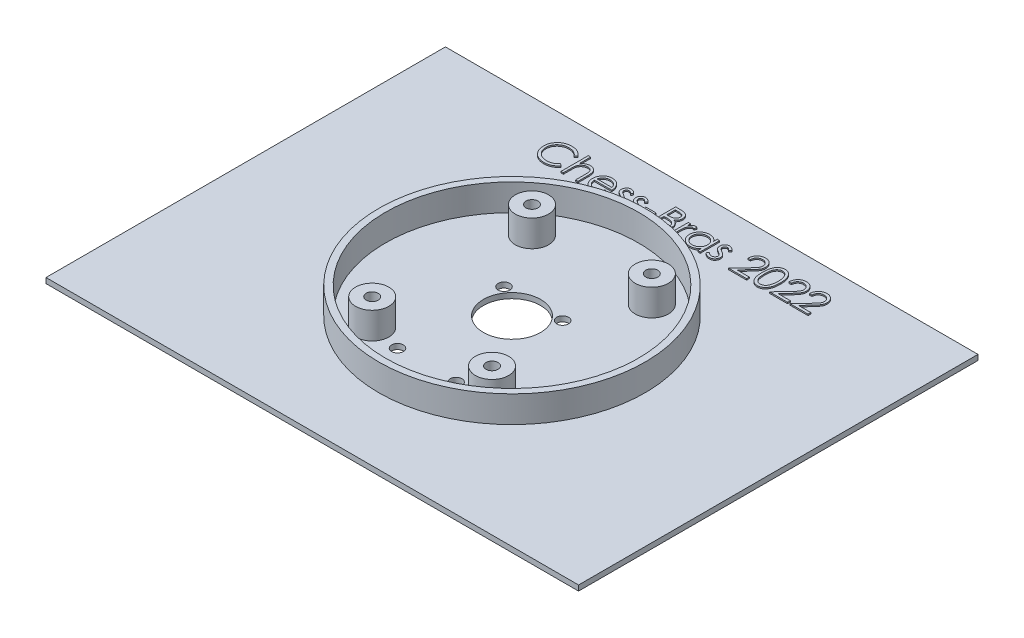
from build123d import *

# Parameters (mm, degrees)
ESQUISSE2_W                                      = 200
ESQUISSE2_H                                      = 150
BOSS_EXTRU_1_DEPTH                               = 1
ESQUISSE3_W                                      = 200
ESQUISSE3_H                                      = 150
BOSS_EXTRU_2_DEPTH                               = 1
ESQUISSE21_R                                     = 6.25
BOSS_EXTRU_6_DEPTH                               = 10
CHAMBRAGE_POUR_VIS_T_TE_CYLINDRIQUE_D            = 2.4
CHAMBRAGE_POUR_VIS_T_TE_CYLINDRIQUE_CBORE_D      = 4.4
CHAMBRAGE_POUR_VIS_T_TE_CYLINDRIQUE_CBORE_DEPTH  = 3.5
CHAMBRAGE_POUR_VIS_T_TE_CYLINDRIQU_2_D           = 4.5
CHAMBRAGE_POUR_VIS_T_TE_CYLINDRIQU_2_CBORE_D     = 8
CHAMBRAGE_POUR_VIS_T_TE_CYLINDRIQU_2_CBORE_DEPTH = 5
ESQUISSE15_R                                     = 10.75
ENL_V_MAT_EXTRU_2_DEPTH                          = 126.39936204
ESQUISSE22_R                                     = 50
ESQUISSE22_R_2                                   = 47.5
BOSS_EXTRU_7_DEPTH                               = 10
BOSS_EXTRU_8_DEPTH                               = 1
ESQUISSE24_W                                     = 3.846153846
ESQUISSE24_H                                     = 1.025641026
BOSS_EXTRU_10_DEPTH                              = 0.5


with BuildPart() as part:
    # Esquisse2 → Boss.-Extru.1 (new body)
    with BuildSketch(Plane(origin=(0, 0, 0), x_dir=(1, 0, 0), z_dir=(0, 1, 0))):
        Rectangle(ESQUISSE2_W, ESQUISSE2_H)
    extrude(amount=BOSS_EXTRU_1_DEPTH)

    # Esquisse3 → Boss.-Extru.2 (add)
    with BuildSketch(Plane(origin=(0, 1, 0), x_dir=(1, 0, 0), z_dir=(0, 1, 0))):
        Rectangle(ESQUISSE3_W, ESQUISSE3_H)
        with BuildLine():
            Line((7.5, 59.529404499), (7.5, 65))
            Line((7.5, 65), (90, 65))
            Line((90, 65), (90, 7.5))
            Line((90, 7.5), (59.529404499, 7.5))
            ThreePointArc((59.529404499, 7.5), (42.426406871, 42.426406871), (7.5, 59.529404499))
        make_face(mode=Mode.SUBTRACT)
        with BuildLine():
            Line((-90, 65), (-90, 7.5))
            Line((-90, 7.5), (-59.529404499, 7.5))
            ThreePointArc((-59.529404499, 7.5), (-42.426406871, 42.426406871), (-7.5, 59.529404499))
            Line((-7.5, 59.529404499), (-7.5, 65))
            Line((-7.5, 65), (-90, 65))
        make_face(mode=Mode.SUBTRACT)
        with BuildLine():
            Line((-90, -65), (-7.5, -65))
            Line((-7.5, -65), (-7.5, -59.529404499))
            ThreePointArc((-7.5, -59.529404499), (-42.426406871, -42.426406871), (-59.529404499, -7.5))
            Line((-59.529404499, -7.5), (-90, -7.5))
            Line((-90, -7.5), (-90, -65))
        make_face(mode=Mode.SUBTRACT)
        with BuildLine():
            Line((90, -65), (90, -7.5))
            Line((90, -7.5), (59.529404499, -7.5))
            ThreePointArc((59.529404499, -7.5), (42.426406871, -42.426406871), (7.5, -59.529404499))
            Line((7.5, -59.529404499), (7.5, -65))
            Line((7.5, -65), (90, -65))
        make_face(mode=Mode.SUBTRACT)
    extrude(amount=BOSS_EXTRU_2_DEPTH)

    # Esquisse21 → Boss.-Extru.6 (add)
    with BuildSketch(Plane(origin=(0, 2, 0), x_dir=(1, 0, 0), z_dir=(0, 1, 0))):
        with Locations(Location((-22.5, 30, 0), (0, 0, 270))):
            Circle(ESQUISSE21_R)
        with Locations(Location((-22.5, -30, 0), (0, 0, 90))):
            Circle(ESQUISSE21_R)
        with Locations(Location((22.5, 30, 0), (0, 0, 90))):
            Circle(ESQUISSE21_R)
        with Locations(Location((22.5, -30, 0), (0, 0, 270))):
            Circle(ESQUISSE21_R)
    extrude(amount=BOSS_EXTRU_6_DEPTH)

    # Chambrage pour vis _ t_te cylindrique (through all)
    with Locations(Plane(origin=(0, 0, 0), x_dir=(-1, 0, 0), z_dir=(0, -1, 0))):
        with Locations((11, 8), (-11, -32), (11, -32), (-11, 8)):
            CounterBoreHole(CHAMBRAGE_POUR_VIS_T_TE_CYLINDRIQUE_D / 2, CHAMBRAGE_POUR_VIS_T_TE_CYLINDRIQUE_CBORE_D / 2, CHAMBRAGE_POUR_VIS_T_TE_CYLINDRIQUE_CBORE_DEPTH)

    # Chambrage pour vis _ t_te cylindriqu 2 (through all)
    with Locations(Plane(origin=(0, 0, 0), x_dir=(-1, 0, 0), z_dir=(0, -1, 0))):
        with Locations((22.5, 30), (22.5, -30), (-22.5, 30), (-22.5, -30)):
            CounterBoreHole(CHAMBRAGE_POUR_VIS_T_TE_CYLINDRIQU_2_D / 2, CHAMBRAGE_POUR_VIS_T_TE_CYLINDRIQU_2_CBORE_D / 2, CHAMBRAGE_POUR_VIS_T_TE_CYLINDRIQU_2_CBORE_DEPTH)

    # Esquisse15 → Enlèv. mat.-Extru.2 (cut, through all)
    with BuildSketch(Plane(origin=(0, 2, 0), x_dir=(1, 0, 0), z_dir=(0, 1, 0))):
        with Locations(Location((0, 0, 0), (0, 0, 270))):
            Circle(ESQUISSE15_R)
    extrude(amount=-ENL_V_MAT_EXTRU_2_DEPTH, mode=Mode.SUBTRACT)

    # Esquisse22 → Boss.-Extru.7 (add)
    with BuildSketch(Plane(origin=(0, 2, 0), x_dir=(1, 0, 0), z_dir=(0, 1, 0))):
        with Locations(Location((0, 0, 0), (0, 0, 270))):
            Circle(ESQUISSE22_R)
        with Locations(Location((0, 0, 0), (0, 0, 270))):
            Circle(ESQUISSE22_R_2, mode=Mode.SUBTRACT)
    extrude(amount=BOSS_EXTRU_7_DEPTH)

    # Esquisse23 → Boss.-Extru.8 (add)
    with BuildSketch(Plane(origin=(0, 1, 0), x_dir=(1, 0, 0), z_dir=(0, 1, 0))):
        with BuildLine():
            Line((-90, -7.5), (-59.529404499, -7.5))
            ThreePointArc((-59.529404499, -7.5), (-42.426406871, -42.426406871), (-7.5, -59.529404499))
            Line((-7.5, -59.529404499), (-7.5, -65))
            Line((-7.5, -65), (-90, -65))
            Line((-90, -65), (-90, -7.5))
        make_face()
        with BuildLine():
            Line((7.5, -59.529404499), (7.5, -65))
            Line((7.5, -65), (90, -65))
            Line((90, -65), (90, -7.5))
            Line((90, -7.5), (59.529404499, -7.5))
            ThreePointArc((59.529404499, -7.5), (42.426406871, -42.426406871), (7.5, -59.529404499))
        make_face()
        with BuildLine():
            Line((-7.5, 59.529404499), (-7.5, 65))
            Line((-7.5, 65), (-90, 65))
            Line((-90, 65), (-90, 7.5))
            Line((-90, 7.5), (-59.529404499, 7.5))
            ThreePointArc((-59.529404499, 7.5), (-42.426406871, 42.426406871), (-7.5, 59.529404499))
        make_face()
        with BuildLine():
            Line((7.5, 59.529404499), (7.5, 65))
            Line((7.5, 65), (90, 65))
            Line((90, 65), (90, 7.5))
            Line((90, 7.5), (59.529404499, 7.5))
            ThreePointArc((59.529404499, 7.5), (42.426406871, 42.426406871), (7.5, 59.529404499))
        make_face()
    extrude(amount=BOSS_EXTRU_8_DEPTH)

    # Esquisse24 → Boss.-Extru.10 (add)
    # profile 1 of 14: a face of its own
    with BuildSketch(Plane(origin=(0, 2, 0), x_dir=(1, 0, 0), z_dir=(0, 1, 0))):
        with BuildLine():
            Line((-39.108275496, 63.852248017), (-39.893531906, 63.251286479))
            add(Edge.make_bspline(
                [(-39.893531906, 63.251286479), (-39.94954873, 63.318046393), (-40.06082715, 63.450666152), (-40.239853442, 63.636893422), (-40.426429565, 63.811365597), (-40.620484197, 63.974913825), (-40.825510253, 64.12181887), (-41.036541106, 64.259736307), (-41.25710695, 64.383358415), (-41.562111906, 64.533252661), (-41.961105758, 64.689670247), (-42.463376727, 64.820822336), (-42.987694151, 64.90431141), (-43.345401578, 64.913353814), (-43.527346009, 64.917953146)],
                knots=[0, 0, 0, 0, 0.757959112, 1.505699292, 2.245454638, 2.979532153, 3.711538275, 4.438200793, 5.171680507, 5.909471876, 7.393775596, 8.890124382, 10.418191784, 12, 12, 12, 12], degree=3))
            add(Edge.make_bspline(
                [(-43.527346009, 64.917953146), (-43.627584007, 64.916798967), (-43.8271297, 64.914501322), (-44.123268196, 64.884189535), (-44.413876913, 64.841586078), (-44.698766817, 64.778370869), (-44.97757527, 64.6984491), (-45.25212499, 64.602947917), (-45.518440989, 64.484791232), (-45.780207384, 64.354196204), (-46.03100513, 64.206689219), (-46.268305266, 64.045793928), (-46.491242318, 63.873310795), (-46.699992638, 63.688593348), (-46.894769633, 63.492473461), (-47.07416195, 63.282861057), (-47.237548836, 63.060426275), (-47.388168908, 62.828102253), (-47.523062432, 62.586565706), (-47.636004944, 62.334922648), (-47.736019579, 62.077482353), (-47.815160272, 61.811336179), (-47.877801749, 61.538356848), (-47.921023644, 61.25781174), (-47.950990705, 60.970286941), (-47.953276924, 60.775403191), (-47.954429342, 60.677167889)],
                knots=[0, 0, 0, 0, 1.054917814, 2.100044995, 3.131103042, 4.146048494, 5.169673617, 6.183595914, 7.203665975, 8.234915748, 9.262203917, 10.264457458, 11.251630812, 12.227803204, 13.197192746, 14.159520551, 15.12972552, 16.100847026, 17.073214652, 18.039054194, 19.002613845, 19.979014051, 20.95965708, 21.949030935, 22.966165397, 24, 24, 24, 24], degree=3))
            add(Edge.make_bspline(
                [(-47.954429342, 60.677167889), (-47.950824145, 60.529364118), (-47.943745818, 60.239171018), (-47.880750578, 59.814112131), (-47.785021746, 59.406910206), (-47.641548669, 59.020110657), (-47.464637096, 58.648943919), (-47.241092492, 58.299690052), (-46.982188099, 57.967071297), (-46.684261186, 57.658948589), (-46.357387426, 57.377480802), (-46.006679108, 57.129621998), (-45.633009714, 56.923008048), (-45.240505056, 56.751076772), (-44.826144731, 56.618914693), (-44.390673867, 56.52587434), (-43.935039595, 56.465182396), (-43.623698452, 56.459371859), (-43.46524665, 56.456414684)],
                knots=[0, 0, 0, 0, 1.029171465, 2.020641659, 2.987623507, 3.938342917, 4.889210282, 5.84687017, 6.821220943, 7.821438502, 8.827599549, 9.822697543, 10.807740252, 11.797342354, 12.80366471, 13.83203677, 14.896651826, 16, 16, 16, 16], degree=3))
            add(Edge.make_bspline(
                [(-43.46524665, 56.456414684), (-43.290667538, 56.461239769), (-42.947054084, 56.470736691), (-42.443145438, 56.551191688), (-41.960757536, 56.681642882), (-41.499864431, 56.864208374), (-41.061765442, 57.101537768), (-40.645774984, 57.389245989), (-40.251541926, 57.730069797), (-40.014481119, 57.990307307), (-39.893531906, 58.123081351)],
                knots=[0, 0, 0, 0, 1.028121516, 2.023589091, 2.998037872, 3.967518031, 4.937445131, 5.927275754, 6.942489185, 8, 8, 8, 8], degree=3))
            Line((-39.893531906, 58.123081351), (-39.108275496, 57.528129428))
            add(Edge.make_bspline(
                [(-39.108275496, 57.528129428), (-39.171470096, 57.446590994), (-39.297556596, 57.28390469), (-39.501722359, 57.054556948), (-39.716800352, 56.838831132), (-39.944388095, 56.6384665), (-40.181867499, 56.449453741), (-40.433502677, 56.277162795), (-40.695985627, 56.11918884), (-40.968426996, 55.974540484), (-41.250537318, 55.846205492), (-41.541978561, 55.736337584), (-41.841494491, 55.641695043), (-42.1490988, 55.563832367), (-42.465429534, 55.503057841), (-42.789345174, 55.462430199), (-43.121544818, 55.434596158), (-43.345663164, 55.432059255), (-43.459237034, 55.430773658)],
                knots=[0, 0, 0, 0, 0.986787822, 1.968848986, 2.935600012, 3.899624008, 4.868462664, 5.837806735, 6.815139263, 7.798259679, 8.787526145, 9.778297419, 10.776456485, 11.791383307, 12.812564526, 13.85620153, 14.913611965, 16, 16, 16, 16], degree=3))
            add(Edge.make_bspline(
                [(-43.459237034, 55.430773658), (-43.566790369, 55.431522209), (-43.779463769, 55.433002374), (-44.093460202, 55.456979995), (-44.399144719, 55.489693529), (-44.69564365, 55.538951046), (-44.984575007, 55.597077732), (-45.263319534, 55.674995608), (-45.534620135, 55.762278941), (-45.797386823, 55.864864618), (-46.051843108, 55.980625139), (-46.297168283, 56.111458165), (-46.533249519, 56.256263492), (-46.762407864, 56.411849236), (-46.981258103, 56.583212956), (-47.191696747, 56.767974769), (-47.394903822, 56.965511943), (-47.520625779, 57.107954381), (-47.583836393, 57.179571735)],
                knots=[0, 0, 0, 0, 1.114604814, 2.203992996, 3.262667896, 4.300477797, 5.318619304, 6.316056647, 7.298880507, 8.271930387, 9.238335007, 10.195173496, 11.151986948, 12.108099108, 13.064862484, 14.031167946, 15.010108607, 16, 16, 16, 16], degree=3))
            add(Edge.make_bspline(
                [(-47.583836393, 57.179571735), (-47.685081089, 57.303975132), (-47.886348166, 57.551280019), (-48.143850119, 57.952097108), (-48.364271705, 58.370577705), (-48.542488622, 58.808920359), (-48.681810716, 59.266141465), (-48.778328416, 59.742471506), (-48.841047286, 60.237465627), (-48.84821954, 60.574142166), (-48.85186524, 60.745276864)],
                knots=[0, 0, 0, 0, 0.994628077, 1.977248131, 2.950237994, 3.925870899, 4.908910175, 5.911660606, 6.938484602, 8, 8, 8, 8], degree=3))
            add(Edge.make_bspline(
                [(-48.85186524, 60.745276864), (-48.847421829, 60.925149588), (-48.838679697, 61.279037944), (-48.764405996, 61.798392096), (-48.644923721, 62.295967521), (-48.475218325, 62.770835363), (-48.260060178, 63.225493307), (-47.994269853, 63.656468178), (-47.680935161, 64.066516177), (-47.322513539, 64.449415466), (-46.92946401, 64.799527902), (-46.508553113, 65.107545627), (-46.060604693, 65.363881387), (-45.590553688, 65.578156137), (-45.094880312, 65.742854603), (-44.574642115, 65.858149422), (-44.030816644, 65.929912611), (-43.659781142, 65.938984634), (-43.471256265, 65.943594171)],
                knots=[0, 0, 0, 0, 1.032925535, 2.032216505, 3.007276963, 3.968222605, 4.92396291, 5.891752235, 6.871517503, 7.883894988, 8.900124299, 9.891468569, 10.874487609, 11.85992873, 12.854644235, 13.869047385, 14.917252991, 16, 16, 16, 16], degree=3))
            add(Edge.make_bspline(
                [(-43.471256265, 65.943594171), (-43.356357774, 65.942216634), (-43.128927782, 65.939489936), (-42.792491632, 65.912900959), (-42.464942126, 65.86857637), (-42.146053606, 65.808244742), (-41.834274703, 65.73336668), (-41.5319883, 65.635822971), (-41.237420623, 65.524290024), (-40.952429457, 65.395837264), (-40.678382171, 65.251646575), (-40.415364118, 65.093316222), (-40.165464522, 64.921042492), (-39.926924955, 64.736290562), (-39.703735781, 64.535151821), (-39.489560128, 64.32315869), (-39.291671333, 64.094204906), (-39.169519347, 63.933047952), (-39.108275496, 63.852248017)],
                knots=[0, 0, 0, 0, 1.096760587, 2.17092713, 3.219439832, 4.250915756, 5.268269357, 6.278326846, 7.281116186, 8.274029601, 9.260640565, 10.235837813, 11.203064059, 12.156899882, 13.114053108, 14.069676657, 15.032185724, 16, 16, 16, 16], degree=3))
        make_face()
    # profile 2 of 14: a face of its own
    with BuildSketch(Plane(origin=(0, 2, 0), x_dir=(1, 0, 0), z_dir=(0, 1, 0))):
        with BuildLine():
            Line((-37.313403701, 65.943594171), (-36.415967804, 65.943594171))
            Line((-36.415967804, 65.943594171), (-36.415967804, 61.614667889))
            add(Edge.make_bspline(
                [(-36.415967804, 61.614667889), (-36.319632656, 61.735079267), (-36.132063187, 61.969526389), (-35.816359997, 62.275415505), (-35.492157505, 62.540554423), (-35.148258049, 62.751612872), (-34.790970848, 62.918345853), (-34.418789006, 63.036596271), (-34.031643374, 63.10931369), (-33.768714374, 63.118452027), (-33.635519086, 63.123081351)],
                knots=[0, 0, 0, 0, 1.125788106, 2.19196713, 3.20547328, 4.180437432, 5.132270164, 6.079753143, 7.027236121, 8, 8, 8, 8], degree=3))
            add(Edge.make_bspline(
                [(-33.635519086, 63.123081351), (-33.500289392, 63.118094407), (-33.235612262, 63.108333756), (-32.850236654, 63.031152667), (-32.49034844, 62.899274272), (-32.157017461, 62.718797058), (-31.857518326, 62.494017551), (-31.592233286, 62.234498915), (-31.375545289, 61.933716292), (-31.228119241, 61.655841281), (-31.132195218, 61.408587698), (-31.071475714, 61.196483377), (-31.01999229, 60.960135054), (-30.975135902, 60.69966439), (-30.945239955, 60.413821043), (-30.921226761, 60.103894602), (-30.904151177, 59.769902836), (-30.90348945, 59.538702123), (-30.903147291, 59.419155069)],
                knots=[0, 0, 0, 0, 1.235656852, 2.418478516, 3.575258207, 4.727955599, 5.870717718, 6.98870536, 8.107142894, 9.245821548, 9.854588956, 10.528768408, 11.260415777, 12.065282286, 12.943670737, 13.886611085, 14.907229059, 16, 16, 16, 16], degree=3))
            Line((-30.903147291, 59.419155069), (-30.903147291, 55.687183915))
            Line((-30.903147291, 55.687183915), (-31.800583188, 55.687183915))
            Line((-31.800583188, 55.687183915), (-31.800583188, 59.124683915))
            add(Edge.make_bspline(
                [(-31.800583188, 59.124683915), (-31.801126912, 59.224177256), (-31.802166962, 59.414491086), (-31.805605089, 59.686965681), (-31.81327999, 59.934097494), (-31.82568235, 60.1550945), (-31.838726085, 60.350264795), (-31.85667842, 60.51932495), (-31.877564803, 60.662507165), (-31.89633275, 60.748691819), (-31.904749855, 60.787344171)],
                knots=[0, 0, 0, 0, 1.430932559, 2.737130458, 3.918967929, 4.986496826, 5.920444988, 6.731744033, 7.431208747, 8, 8, 8, 8], degree=3))
            add(Edge.make_bspline(
                [(-31.904749855, 60.787344171), (-31.937390555, 60.900756353), (-32.000142111, 61.118790612), (-32.145993475, 61.414968927), (-32.328162078, 61.667496757), (-32.550582825, 61.872966152), (-32.809321008, 62.034141979), (-33.106063763, 62.145764214), (-33.438018244, 62.215043419), (-33.671879592, 62.222012858), (-33.793772291, 62.225645453)],
                knots=[0, 0, 0, 0, 1.090059168, 2.095632401, 3.037101401, 3.955032261, 4.878929692, 5.839099886, 6.873700383, 8, 8, 8, 8], degree=3))
            add(Edge.make_bspline(
                [(-33.793772291, 62.225645453), (-33.865965928, 62.22428595), (-34.008835272, 62.221595527), (-34.220688603, 62.194584388), (-34.426200213, 62.150445192), (-34.627349293, 62.090717939), (-34.819872715, 62.009444977), (-35.009382215, 61.915358722), (-35.190508526, 61.800192279), (-35.366468003, 61.670975801), (-35.530232384, 61.527919344), (-35.682595571, 61.376928044), (-35.8184194, 61.216142432), (-35.941472517, 61.048142101), (-36.04769619, 60.870622691), (-36.140419282, 60.685296067), (-36.2190927, 60.491918508), (-36.258186106, 60.357704046), (-36.27774665, 60.290549299)],
                knots=[0, 0, 0, 0, 1.024319606, 2.027102035, 3.025350316, 4.005802111, 5.00026367, 5.987881639, 7.005602596, 8.042517216, 9.083927026, 10.089214625, 11.084353441, 12.06828073, 13.041928858, 14.016821737, 15.00770877, 16, 16, 16, 16], degree=3))
            add(Edge.make_bspline(
                [(-36.27774665, 60.290549299), (-36.289002156, 60.241918011), (-36.31352929, 60.135944448), (-36.340143099, 59.961160665), (-36.363965375, 59.758056745), (-36.384104089, 59.526940745), (-36.396455764, 59.266965767), (-36.409765024, 58.979905884), (-36.414719349, 58.663962967), (-36.415539215, 58.444261517), (-36.415967804, 58.329411479)],
                knots=[0, 0, 0, 0, 0.607992626, 1.324890765, 2.152360218, 3.099583803, 4.150613268, 5.323148443, 6.60066238, 8, 8, 8, 8], degree=3))
            Line((-36.415967804, 58.329411479), (-36.415967804, 55.687183915))
            Line((-36.415967804, 55.687183915), (-37.313403701, 55.687183915))
            Line((-37.313403701, 55.687183915), (-37.313403701, 65.943594171))
        make_face()
    # profile 3 of 14: a face of its own
    with BuildSketch(Plane(origin=(0, 2, 0), x_dir=(1, 0, 0), z_dir=(0, 1, 0))):
        with BuildLine():
            Line((-22.854269086, 57.994876223), (-22.056993445, 57.576206351))
            add(Edge.make_bspline(
                [(-22.056993445, 57.576206351), (-22.120526574, 57.463511119), (-22.244136884, 57.244250825), (-22.456710449, 56.943016938), (-22.679544942, 56.672023464), (-22.922699137, 56.438510166), (-23.178898219, 56.23493478), (-23.449562947, 56.05682671), (-23.736102427, 55.905059509), (-24.038530212, 55.777195143), (-24.359386072, 55.678882303), (-24.699447547, 55.609441672), (-25.059366106, 55.566518047), (-25.306069477, 55.561531931), (-25.432394086, 55.558978787)],
                knots=[0, 0, 0, 0, 1.120438281, 2.179929193, 3.190490725, 4.156257408, 5.095198341, 6.022838206, 6.959905092, 7.901321166, 8.864066838, 9.862729781, 10.905609505, 12, 12, 12, 12], degree=3))
            add(Edge.make_bspline(
                [(-25.432394086, 55.558978787), (-25.572799736, 55.56225643), (-25.846690483, 55.568650164), (-26.245375475, 55.623771491), (-26.620745242, 55.713692516), (-26.97277868, 55.839308349), (-27.300613687, 56.003386417), (-27.604901844, 56.203270651), (-27.887243347, 56.437934236), (-28.138741087, 56.709409789), (-28.365152181, 56.999929667), (-28.564940238, 57.302660765), (-28.731961469, 57.616841407), (-28.86782607, 57.940471475), (-28.977554255, 58.271511171), (-29.054030552, 58.612972507), (-29.098115546, 58.963931319), (-29.104871105, 59.201352278), (-29.108275496, 59.320998017)],
                knots=[0, 0, 0, 0, 1.145258523, 2.234067595, 3.276747158, 4.290159414, 5.277019952, 6.260822364, 7.254936242, 8.264827045, 9.274100331, 10.257902744, 11.220704747, 12.172965371, 13.118907548, 14.062713208, 15.023725156, 16, 16, 16, 16], degree=3))
            add(Edge.make_bspline(
                [(-29.108275496, 59.320998017), (-29.105249378, 59.433268961), (-29.099252011, 59.655775146), (-29.061449762, 59.985105273), (-28.994454639, 60.305186566), (-28.902522285, 60.616284989), (-28.783804438, 60.917879658), (-28.638569526, 61.210154125), (-28.466591304, 61.492797382), (-28.333812236, 61.67109205), (-28.266929342, 61.760901864)],
                knots=[0, 0, 0, 0, 1.024358464, 2.0301432, 3.019427413, 4.004406732, 4.986367066, 5.972626655, 6.978780325, 8, 8, 8, 8], degree=3))
            add(Edge.make_bspline(
                [(-28.266929342, 61.760901864), (-28.176335963, 61.869098635), (-27.998018972, 62.082064779), (-27.696429386, 62.361888567), (-27.369857396, 62.596299354), (-27.022395607, 62.790605457), (-26.650005681, 62.938244448), (-26.257693421, 63.048266112), (-25.840991746, 63.109917572), (-25.556119687, 63.118625668), (-25.410358829, 63.123081351)],
                knots=[0, 0, 0, 0, 1.030682036, 2.02871468, 2.997146059, 3.962720338, 4.930598197, 5.918074684, 6.934738563, 8, 8, 8, 8], degree=3))
            add(Edge.make_bspline(
                [(-25.410358829, 63.123081351), (-25.260508528, 63.11921264), (-24.966536397, 63.11162311), (-24.537873194, 63.041262158), (-24.132271147, 62.92968343), (-23.749892563, 62.772101172), (-23.390698675, 62.568788167), (-23.057024248, 62.316954334), (-22.743162784, 62.024331227), (-22.560566844, 61.799293486), (-22.467650496, 61.684780069)],
                knots=[0, 0, 0, 0, 1.056321875, 2.072262726, 3.055038591, 4.01806755, 4.982017516, 5.957941055, 6.960871419, 8, 8, 8, 8], degree=3))
            add(Edge.make_bspline(
                [(-22.467650496, 61.684780069), (-22.404430672, 61.598484122), (-22.278411835, 61.42646664), (-22.120562978, 61.14597762), (-21.983541849, 60.852518779), (-21.874019103, 60.541346501), (-21.785334814, 60.216147701), (-21.721172475, 59.874597573), (-21.683544993, 59.516797826), (-21.676148715, 59.273007668), (-21.67237806, 59.148722376)],
                knots=[0, 0, 0, 0, 0.94817472, 1.890038105, 2.849395472, 3.817997239, 4.812318967, 5.836947057, 6.897266129, 8, 8, 8, 8], degree=3))
            Line((-21.67237806, 59.148722376), (-28.210839598, 59.148722376))
            add(Edge.make_bspline(
                [(-28.210839598, 59.148722376), (-28.206440723, 59.052435336), (-28.197790512, 58.863090754), (-28.157461531, 58.586031373), (-28.093893606, 58.322107539), (-28.004553427, 58.073298847), (-27.896362441, 57.836355626), (-27.763831821, 57.61303552), (-27.60571881, 57.40435572), (-27.429359669, 57.208449613), (-27.233053682, 57.033990295), (-27.026531547, 56.877842363), (-26.806835647, 56.746969229), (-26.575698266, 56.640740973), (-26.333493166, 56.55758007), (-26.080144037, 56.500814868), (-25.816149419, 56.462794563), (-25.636190178, 56.458566948), (-25.544573573, 56.456414684)],
                knots=[0, 0, 0, 0, 1.094153842, 2.151609401, 3.174256925, 4.172055639, 5.149267565, 6.128595816, 7.11444997, 8.118368179, 9.117203808, 10.09244225, 11.054858984, 12.015122123, 12.976791628, 13.957293641, 14.960065497, 16, 16, 16, 16], degree=3))
            add(Edge.make_bspline(
                [(-25.544573573, 56.456414684), (-25.454998865, 56.458151989), (-25.277265463, 56.461599135), (-25.012577299, 56.49511888), (-24.752178649, 56.549319668), (-24.497147268, 56.623291068), (-24.252659137, 56.713510645), (-24.02624328, 56.822375953), (-23.818014092, 56.942803801), (-23.623394188, 57.080545729), (-23.434619921, 57.249140549), (-23.247355674, 57.459528324), (-23.046565236, 57.708349832), (-22.920880685, 57.895623163), (-22.854269086, 57.994876223)],
                knots=[0, 0, 0, 0, 0.99110716, 1.966546729, 2.947904876, 3.932708344, 4.903319531, 5.828989031, 6.710028674, 7.56322171, 8.463672341, 9.504779593, 10.677557249, 12, 12, 12, 12], degree=3))
        make_face()
        with BuildLine():
            add(Edge.make_bspline(
                [(-22.569813957, 60.046158274), (-22.602661456, 60.165195056), (-22.665882318, 60.394302543), (-22.797986216, 60.71156223), (-22.946762047, 60.993527662), (-23.122824136, 61.238040899), (-23.322306209, 61.455193793), (-23.552721017, 61.644961179), (-23.811109284, 61.814725325), (-24.0961354, 61.958018181), (-24.397969072, 62.079989206), (-24.713986763, 62.161775251), (-25.036437586, 62.217802515), (-25.254535547, 62.223019967), (-25.364285111, 62.225645453)],
                knots=[0, 0, 0, 0, 1.154881502, 2.222775134, 3.210006277, 4.132804581, 5.035138423, 5.962687519, 6.919655026, 7.923214229, 8.944639381, 9.960483929, 10.97369054, 12, 12, 12, 12], degree=3))
            add(Edge.make_bspline(
                [(-25.364285111, 62.225645453), (-25.453854936, 62.22389782), (-25.630915647, 62.220443117), (-25.891775842, 62.187671319), (-26.142289268, 62.133500334), (-26.384304375, 62.059314744), (-26.614649713, 61.960433022), (-26.838063337, 61.844480946), (-27.048864469, 61.702933564), (-27.180696742, 61.595051121), (-27.247297932, 61.540549299)],
                knots=[0, 0, 0, 0, 1.04873581, 2.073130211, 3.073294108, 4.04793562, 5.032784715, 6.005352987, 6.992311501, 8, 8, 8, 8], degree=3))
            add(Edge.make_bspline(
                [(-27.247297932, 61.540549299), (-27.294993023, 61.497422683), (-27.391516264, 61.410144923), (-27.520489182, 61.259775762), (-27.643976247, 61.097628441), (-27.756358112, 60.917499514), (-27.859436931, 60.721440145), (-27.955894008, 60.511104044), (-28.042712329, 60.284895101), (-28.091558357, 60.12725956), (-28.116688957, 60.046158274)],
                knots=[0, 0, 0, 0, 0.879870761, 1.780643979, 2.707998968, 3.669668524, 4.684282772, 5.740141944, 6.837334558, 8, 8, 8, 8], degree=3))
            Line((-28.116688957, 60.046158274), (-22.569813957, 60.046158274))
        make_face(mode=Mode.SUBTRACT)
    # profile 4 of 14: a face of its own
    with BuildSketch(Plane(origin=(0, 2, 0), x_dir=(1, 0, 0), z_dir=(0, 1, 0))):
        with BuildLine():
            Line((-16.415967804, 62.083417889), (-17.024942163, 61.456414684))
            add(Edge.make_bspline(
                [(-17.024942163, 61.456414684), (-17.077486458, 61.517309388), (-17.178785675, 61.634707208), (-17.339447049, 61.791670255), (-17.499514488, 61.923490081), (-17.656796812, 62.034782249), (-17.81524901, 62.118922668), (-17.973011633, 62.180336559), (-18.130248029, 62.218341718), (-18.235350987, 62.223240114), (-18.286961393, 62.225645453)],
                knots=[0, 0, 0, 0, 1.26578478, 2.440284043, 3.530471711, 4.527705817, 5.468200915, 6.346673037, 7.188140097, 8, 8, 8, 8], degree=3))
            add(Edge.make_bspline(
                [(-18.286961393, 62.225645453), (-18.350216793, 62.222574388), (-18.474694467, 62.216530965), (-18.653053948, 62.156206878), (-18.818627162, 62.063610483), (-18.961932819, 61.932271673), (-19.083326191, 61.781516619), (-19.171936708, 61.612955691), (-19.226125233, 61.431675566), (-19.232995896, 61.305875972), (-19.236480624, 61.242071735)],
                knots=[0, 0, 0, 0, 0.99966794, 1.967205029, 2.953328237, 3.988086729, 5.028030931, 6.008226631, 6.989793394, 8, 8, 8, 8], degree=3))
            add(Edge.make_bspline(
                [(-19.236480624, 61.242071735), (-19.233306875, 61.184323038), (-19.226968323, 61.068988435), (-19.177692097, 60.898851196), (-19.099217605, 60.732973944), (-19.025874192, 60.63136564), (-18.988083188, 60.579010838)],
                knots=[0, 0, 0, 0, 0.960159726, 1.917612774, 2.927026955, 4, 4, 4, 4], degree=3))
            add(Edge.make_bspline(
                [(-18.988083188, 60.579010838), (-18.965330349, 60.551054883), (-18.916903798, 60.491554155), (-18.826022327, 60.408971717), (-18.72310089, 60.317708143), (-18.599329639, 60.226460037), (-18.460040988, 60.130369394), (-18.302214462, 60.033220442), (-18.130858733, 59.9276078), (-18.008180714, 59.860623698), (-17.944413316, 59.82580571)],
                knots=[0, 0, 0, 0, 0.66740084, 1.420478572, 2.27185888, 3.217733974, 4.268547843, 5.408967954, 6.65319498, 8, 8, 8, 8], degree=3))
            add(Edge.make_bspline(
                [(-17.944413316, 59.82580571), (-17.866660239, 59.782248845), (-17.716466896, 59.698111323), (-17.50305899, 59.567512171), (-17.30938173, 59.437708101), (-17.133794108, 59.310087319), (-16.979674654, 59.181079125), (-16.842347361, 59.055628391), (-16.725237521, 58.929944653), (-16.659654873, 58.842135757), (-16.628307547, 58.800164684)],
                knots=[0, 0, 0, 0, 1.27191281, 2.456916733, 3.569705269, 4.599008579, 5.553216877, 6.436649441, 7.252746552, 8, 8, 8, 8], degree=3))
            add(Edge.make_bspline(
                [(-16.628307547, 58.800164684), (-16.576277469, 58.715404432), (-16.472727956, 58.546715801), (-16.363990052, 58.268948865), (-16.300960696, 57.97434743), (-16.292211495, 57.772826801), (-16.287762675, 57.670356992)],
                knots=[0, 0, 0, 0, 0.995354457, 1.980940102, 2.973342416, 4, 4, 4, 4], degree=3))
            add(Edge.make_bspline(
                [(-16.287762675, 57.670356992), (-16.289818486, 57.598159431), (-16.293869686, 57.455886251), (-16.322035592, 57.246358166), (-16.370478381, 57.045973716), (-16.436460535, 56.852558617), (-16.525558744, 56.669818789), (-16.629981021, 56.493143792), (-16.755337912, 56.326355418), (-16.898456128, 56.169672675), (-17.055157539, 56.026570539), (-17.222317935, 55.900787814), (-17.400143165, 55.796289708), (-17.587362598, 55.709817293), (-17.784401609, 55.641050842), (-17.991291007, 55.593443609), (-18.207373163, 55.564950006), (-18.354315472, 55.56099436), (-18.429188957, 55.558978787)],
                knots=[0, 0, 0, 0, 1.032770009, 2.035186124, 3.017557409, 3.978232242, 4.952395191, 5.920591857, 6.910227898, 7.931268572, 8.952309245, 9.941945286, 10.918353717, 11.897095711, 12.887975737, 13.898235213, 14.929059601, 16, 16, 16, 16], degree=3))
            add(Edge.make_bspline(
                [(-18.429188957, 55.558978787), (-18.53023803, 55.561815073), (-18.730932107, 55.567448237), (-19.027759876, 55.620322697), (-19.317819187, 55.702595251), (-19.598915016, 55.816069349), (-19.864761056, 55.9593571), (-20.107992269, 56.130963939), (-20.32945359, 56.325221074), (-20.455505801, 56.474115105), (-20.518531906, 56.54856212)],
                knots=[0, 0, 0, 0, 1.013940152, 2.01379169, 3.017749504, 4.037548394, 5.051665909, 6.043208538, 7.021604269, 8, 8, 8, 8], degree=3))
            Line((-20.518531906, 56.54856212), (-19.923579983, 57.225645453))
            add(Edge.make_bspline(
                [(-19.923579983, 57.225645453), (-19.867087375, 57.16463184), (-19.757567911, 57.046347726), (-19.582421577, 56.88884961), (-19.404194717, 56.756845978), (-19.224667041, 56.646436222), (-19.041181057, 56.561363641), (-18.854765017, 56.50159623), (-18.665798091, 56.463184252), (-18.538877703, 56.458674874), (-18.475262675, 56.456414684)],
                knots=[0, 0, 0, 0, 1.179806542, 2.287233372, 3.337373186, 4.324005949, 5.273901747, 6.200048787, 7.097828587, 8, 8, 8, 8], degree=3))
            add(Edge.make_bspline(
                [(-18.475262675, 56.456414684), (-18.38864003, 56.460331327), (-18.219393911, 56.467983789), (-17.976983172, 56.537461195), (-17.753158525, 56.646403914), (-17.558806109, 56.800931623), (-17.393371363, 56.980804688), (-17.273576579, 57.183416457), (-17.198501792, 57.402820619), (-17.189684653, 57.554912912), (-17.185198573, 57.632296094)],
                knots=[0, 0, 0, 0, 1.072336372, 2.095165389, 3.102688358, 4.141489647, 5.156069229, 6.117746104, 7.042326257, 8, 8, 8, 8], degree=3))
            add(Edge.make_bspline(
                [(-17.185198573, 57.632296094), (-17.188302271, 57.696037862), (-17.194430107, 57.821887449), (-17.242553742, 58.004031281), (-17.318590462, 58.176800654), (-17.393460886, 58.277913932), (-17.431592804, 58.329411479)],
                knots=[0, 0, 0, 0, 1.013901739, 2.00181326, 2.98231254, 4, 4, 4, 4], degree=3))
            add(Edge.make_bspline(
                [(-17.431592804, 58.329411479), (-17.454513931, 58.355226799), (-17.504444423, 58.411461891), (-17.596030827, 58.492676402), (-17.70569329, 58.580213828), (-17.834665184, 58.672589796), (-17.983206504, 58.768585812), (-18.151919291, 58.867698247), (-18.338492298, 58.974634606), (-18.470408388, 59.045547907), (-18.53936524, 59.082616607)],
                knots=[0, 0, 0, 0, 0.615000592, 1.339693406, 2.178160186, 3.116406724, 4.166410947, 5.330106347, 6.604359322, 8, 8, 8, 8], degree=3))
            add(Edge.make_bspline(
                [(-18.53936524, 59.082616607), (-18.613784211, 59.124156983), (-18.758106347, 59.20471703), (-18.962527178, 59.330191545), (-19.14694819, 59.45781233), (-19.315806975, 59.580420442), (-19.464838419, 59.704480282), (-19.593455414, 59.830129572), (-19.706721745, 59.95230096), (-19.769428636, 60.038864665), (-19.799381265, 60.080212761)],
                knots=[0, 0, 0, 0, 1.262093308, 2.447601706, 3.550203992, 4.582594899, 5.537233252, 6.418365656, 7.244515135, 8, 8, 8, 8], degree=3))
            add(Edge.make_bspline(
                [(-19.799381265, 60.080212761), (-19.851182978, 60.163485947), (-19.954804508, 60.330061419), (-20.05541934, 60.608091353), (-20.124579422, 60.900791516), (-20.13075768, 61.102753957), (-20.133916522, 61.206014043)],
                knots=[0, 0, 0, 0, 0.985009483, 1.970363186, 2.962279964, 4, 4, 4, 4], degree=3))
            add(Edge.make_bspline(
                [(-20.133916522, 61.206014043), (-20.132390249, 61.27351518), (-20.129403118, 61.405624469), (-20.105562971, 61.599735384), (-20.062158081, 61.78415868), (-20.007715445, 61.961664003), (-19.932049719, 62.128812843), (-19.841632847, 62.287834189), (-19.735383061, 62.438508241), (-19.612973659, 62.578517189), (-19.478383244, 62.705686693), (-19.332969616, 62.816539916), (-19.180003169, 62.911129501), (-19.018836256, 62.990458531), (-18.847920619, 63.050462482), (-18.668450943, 63.091769296), (-18.480790501, 63.11935559), (-18.352501569, 63.121821545), (-18.286961393, 63.123081351)],
                knots=[0, 0, 0, 0, 1.087655834, 2.128696564, 3.144119009, 4.137814668, 5.115653402, 6.093965665, 7.082169637, 8.081268856, 9.086088321, 10.061021666, 11.022561449, 11.980240094, 12.950172527, 13.934149372, 14.944599409, 16, 16, 16, 16], degree=3))
            add(Edge.make_bspline(
                [(-18.286961393, 63.123081351), (-18.209269783, 63.119926092), (-18.05242915, 63.113556384), (-17.817130218, 63.062968696), (-17.582177812, 62.979731256), (-17.346968241, 62.86477059), (-17.113224557, 62.716008087), (-16.878890681, 62.536210089), (-16.641153451, 62.326559476), (-16.492706842, 62.166275975), (-16.415967804, 62.083417889)],
                knots=[0, 0, 0, 0, 0.845714091, 1.707292901, 2.609013841, 3.555613372, 4.552488639, 5.621697636, 6.770543573, 8, 8, 8, 8], degree=3))
        make_face()
    # profile 5 of 14: a face of its own
    with BuildSketch(Plane(origin=(0, 2, 0), x_dir=(1, 0, 0), z_dir=(0, 1, 0))):
        with BuildLine():
            Line((-11.031352419, 62.083417889), (-11.640326778, 61.456414684))
            add(Edge.make_bspline(
                [(-11.640326778, 61.456414684), (-11.692871074, 61.517309388), (-11.79417029, 61.634707208), (-11.954831665, 61.791670255), (-12.114899103, 61.923490081), (-12.272181428, 62.034782249), (-12.430633625, 62.118922668), (-12.588396248, 62.180336559), (-12.745632644, 62.218341718), (-12.850735602, 62.223240114), (-12.902346009, 62.225645453)],
                knots=[0, 0, 0, 0, 1.26578478, 2.440284043, 3.530471711, 4.527705817, 5.468200915, 6.346673037, 7.188140097, 8, 8, 8, 8], degree=3))
            add(Edge.make_bspline(
                [(-12.902346009, 62.225645453), (-12.965601408, 62.222574388), (-13.090079082, 62.216530965), (-13.268438563, 62.156206878), (-13.434011778, 62.063610483), (-13.577317435, 61.932271673), (-13.698710806, 61.781516619), (-13.787321324, 61.612955691), (-13.841509848, 61.431675566), (-13.848380511, 61.305875972), (-13.85186524, 61.242071735)],
                knots=[0, 0, 0, 0, 0.99966794, 1.967205029, 2.953328237, 3.988086729, 5.028030931, 6.008226631, 6.989793394, 8, 8, 8, 8], degree=3))
            add(Edge.make_bspline(
                [(-13.85186524, 61.242071735), (-13.84869149, 61.184323038), (-13.842352938, 61.068988435), (-13.793076712, 60.898851196), (-13.71460222, 60.732973944), (-13.641258808, 60.63136564), (-13.603467804, 60.579010838)],
                knots=[0, 0, 0, 0, 0.960159726, 1.917612774, 2.927026955, 4, 4, 4, 4], degree=3))
            add(Edge.make_bspline(
                [(-13.603467804, 60.579010838), (-13.580714964, 60.551054883), (-13.532288413, 60.491554155), (-13.441406942, 60.408971717), (-13.338485505, 60.317708143), (-13.214714255, 60.226460037), (-13.075425603, 60.130369394), (-12.917599077, 60.033220442), (-12.746243349, 59.9276078), (-12.62356533, 59.860623698), (-12.559797932, 59.82580571)],
                knots=[0, 0, 0, 0, 0.66740084, 1.420478572, 2.27185888, 3.217733974, 4.268547843, 5.408967954, 6.65319498, 8, 8, 8, 8], degree=3))
            add(Edge.make_bspline(
                [(-12.559797932, 59.82580571), (-12.482044854, 59.782248845), (-12.331851511, 59.698111323), (-12.118443605, 59.567512171), (-11.924766345, 59.437708101), (-11.749178723, 59.310087319), (-11.595059269, 59.181079125), (-11.457731976, 59.055628391), (-11.340622136, 58.929944653), (-11.275039489, 58.842135757), (-11.243692163, 58.800164684)],
                knots=[0, 0, 0, 0, 1.27191281, 2.456916733, 3.569705269, 4.599008579, 5.553216877, 6.436649441, 7.252746552, 8, 8, 8, 8], degree=3))
            add(Edge.make_bspline(
                [(-11.243692163, 58.800164684), (-11.191662084, 58.715404432), (-11.088112572, 58.546715801), (-10.979374668, 58.268948865), (-10.916345311, 57.97434743), (-10.90759611, 57.772826801), (-10.903147291, 57.670356992)],
                knots=[0, 0, 0, 0, 0.995354457, 1.980940102, 2.973342416, 4, 4, 4, 4], degree=3))
            add(Edge.make_bspline(
                [(-10.903147291, 57.670356992), (-10.905203102, 57.598159431), (-10.909254302, 57.455886251), (-10.937420207, 57.246358166), (-10.985862997, 57.045973716), (-11.051845151, 56.852558617), (-11.140943359, 56.669818789), (-11.245365637, 56.493143792), (-11.370722527, 56.326355418), (-11.513840743, 56.169672675), (-11.670542155, 56.026570539), (-11.83770255, 55.900787814), (-12.01552778, 55.796289708), (-12.202747213, 55.709817293), (-12.399786225, 55.641050842), (-12.606675623, 55.593443609), (-12.822757779, 55.564950006), (-12.969700088, 55.56099436), (-13.044573573, 55.558978787)],
                knots=[0, 0, 0, 0, 1.032770009, 2.035186124, 3.017557409, 3.978232242, 4.952395191, 5.920591857, 6.910227898, 7.931268572, 8.952309245, 9.941945286, 10.918353717, 11.897095711, 12.887975737, 13.898235213, 14.929059601, 16, 16, 16, 16], degree=3))
            add(Edge.make_bspline(
                [(-13.044573573, 55.558978787), (-13.145622646, 55.561815073), (-13.346316722, 55.567448237), (-13.643144491, 55.620322697), (-13.933203802, 55.702595251), (-14.214299631, 55.816069349), (-14.480145671, 55.9593571), (-14.723376884, 56.130963939), (-14.944838206, 56.325221074), (-15.070890416, 56.474115105), (-15.133916522, 56.54856212)],
                knots=[0, 0, 0, 0, 1.013940152, 2.01379169, 3.017749504, 4.037548394, 5.051665909, 6.043208538, 7.021604269, 8, 8, 8, 8], degree=3))
            Line((-15.133916522, 56.54856212), (-14.538964598, 57.225645453))
            add(Edge.make_bspline(
                [(-14.538964598, 57.225645453), (-14.48247199, 57.16463184), (-14.372952527, 57.046347726), (-14.197806193, 56.88884961), (-14.019579333, 56.756845978), (-13.840051657, 56.646436222), (-13.656565673, 56.561363641), (-13.470149632, 56.50159623), (-13.281182706, 56.463184252), (-13.154262318, 56.458674874), (-13.090647291, 56.456414684)],
                knots=[0, 0, 0, 0, 1.179806542, 2.287233372, 3.337373186, 4.324005949, 5.273901747, 6.200048787, 7.097828587, 8, 8, 8, 8], degree=3))
            add(Edge.make_bspline(
                [(-13.090647291, 56.456414684), (-13.004024645, 56.460331327), (-12.834778526, 56.467983789), (-12.592367787, 56.537461195), (-12.36854314, 56.646403914), (-12.174190725, 56.800931623), (-12.008755979, 56.980804688), (-11.888961195, 57.183416457), (-11.813886408, 57.402820619), (-11.805069269, 57.554912912), (-11.800583188, 57.632296094)],
                knots=[0, 0, 0, 0, 1.072336372, 2.095165389, 3.102688358, 4.141489647, 5.156069229, 6.117746104, 7.042326257, 8, 8, 8, 8], degree=3))
            add(Edge.make_bspline(
                [(-11.800583188, 57.632296094), (-11.803686886, 57.696037862), (-11.809814723, 57.821887449), (-11.857938357, 58.004031281), (-11.933975078, 58.176800654), (-12.008845502, 58.277913932), (-12.046977419, 58.329411479)],
                knots=[0, 0, 0, 0, 1.013901739, 2.00181326, 2.98231254, 4, 4, 4, 4], degree=3))
            add(Edge.make_bspline(
                [(-12.046977419, 58.329411479), (-12.069898546, 58.355226799), (-12.119829039, 58.411461891), (-12.211415442, 58.492676402), (-12.321077906, 58.580213828), (-12.4500498, 58.672589796), (-12.59859112, 58.768585812), (-12.767303906, 58.867698247), (-12.953876914, 58.974634606), (-13.085793003, 59.045547907), (-13.154749855, 59.082616607)],
                knots=[0, 0, 0, 0, 0.615000592, 1.339693406, 2.178160186, 3.116406724, 4.166410947, 5.330106347, 6.604359322, 8, 8, 8, 8], degree=3))
            add(Edge.make_bspline(
                [(-13.154749855, 59.082616607), (-13.229168826, 59.124156983), (-13.373490962, 59.20471703), (-13.577911793, 59.330191545), (-13.762332805, 59.45781233), (-13.93119159, 59.580420442), (-14.080223035, 59.704480282), (-14.20884003, 59.830129572), (-14.322106361, 59.95230096), (-14.384813251, 60.038864665), (-14.414765881, 60.080212761)],
                knots=[0, 0, 0, 0, 1.262093308, 2.447601706, 3.550203992, 4.582594899, 5.537233252, 6.418365656, 7.244515135, 8, 8, 8, 8], degree=3))
            add(Edge.make_bspline(
                [(-14.414765881, 60.080212761), (-14.466567594, 60.163485947), (-14.570189123, 60.330061419), (-14.670803955, 60.608091353), (-14.739964037, 60.900791516), (-14.746142295, 61.102753957), (-14.749301137, 61.206014043)],
                knots=[0, 0, 0, 0, 0.985009483, 1.970363186, 2.962279964, 4, 4, 4, 4], degree=3))
            add(Edge.make_bspline(
                [(-14.749301137, 61.206014043), (-14.747774865, 61.27351518), (-14.744787733, 61.405624469), (-14.720947586, 61.599735384), (-14.677542697, 61.78415868), (-14.623100061, 61.961664003), (-14.547434334, 62.128812843), (-14.457017462, 62.287834189), (-14.350767677, 62.438508241), (-14.228358274, 62.578517189), (-14.093767859, 62.705686693), (-13.948354231, 62.816539916), (-13.795387784, 62.911129501), (-13.634220871, 62.990458531), (-13.463305234, 63.050462482), (-13.283835559, 63.091769296), (-13.096175116, 63.11935559), (-12.967886185, 63.121821545), (-12.902346009, 63.123081351)],
                knots=[0, 0, 0, 0, 1.087655834, 2.128696564, 3.144119009, 4.137814668, 5.115653402, 6.093965665, 7.082169637, 8.081268856, 9.086088321, 10.061021666, 11.022561449, 11.980240094, 12.950172527, 13.934149372, 14.944599409, 16, 16, 16, 16], degree=3))
            add(Edge.make_bspline(
                [(-12.902346009, 63.123081351), (-12.824654399, 63.119926092), (-12.667813765, 63.113556384), (-12.432514834, 63.062968696), (-12.197562428, 62.979731256), (-11.962352856, 62.86477059), (-11.728609172, 62.716008087), (-11.494275296, 62.536210089), (-11.256538067, 62.326559476), (-11.108091458, 62.166275975), (-11.031352419, 62.083417889)],
                knots=[0, 0, 0, 0, 0.845714091, 1.707292901, 2.609013841, 3.555613372, 4.552488639, 5.621697636, 6.770543573, 8, 8, 8, 8], degree=3))
        make_face()
    # profile 6 of 14: a face of its own
    with BuildSketch(Plane(origin=(0, 2, 0), x_dir=(1, 0, 0), z_dir=(0, 1, 0))):
        with Locations((-7.826224214, 59.533337761)):
            Rectangle(ESQUISSE24_W, ESQUISSE24_H)
    # profile 7 of 14: a face of its own
    with BuildSketch(Plane(origin=(0, 2, 0), x_dir=(1, 0, 0), z_dir=(0, 1, 0))):
        with BuildLine():
            Line((-4.236480624, 65.687183915), (-2.285358829, 65.687183915))
            add(Edge.make_bspline(
                [(-2.285358829, 65.687183915), (-2.189848892, 65.686681771), (-2.004726862, 65.685708491), (-1.735528457, 65.67061383), (-1.483388998, 65.650031916), (-1.248235363, 65.617374509), (-1.030176213, 65.577969431), (-0.828554392, 65.530249957), (-0.644011043, 65.473031061), (-0.423688939, 65.382041686), (-0.172487051, 65.246832633), (0.099508357, 65.047036733), (0.332091898, 64.802658267), (0.532624233, 64.526993537), (0.692056003, 64.223748475), (0.807396853, 63.900150793), (0.880419354, 63.560374387), (0.887929166, 63.327108165), (0.891724504, 63.209219171)],
                knots=[0, 0, 0, 0, 1.001505555, 1.941167018, 2.826882275, 3.653841531, 4.429895133, 5.150066043, 5.825578002, 6.45369114, 7.647487171, 8.808567382, 9.977351308, 11.170798116, 12.373658725, 13.556498008, 14.765093433, 16, 16, 16, 16], degree=3))
            add(Edge.make_bspline(
                [(0.891724504, 63.209219171), (0.888601023, 63.098783298), (0.882463088, 62.881766392), (0.823769489, 62.564354651), (0.731881865, 62.262208312), (0.604152582, 61.976430068), (0.438146879, 61.713476887), (0.241408825, 61.471227556), (0.004046532, 61.259938821), (-0.173791296, 61.141816243), (-0.264124855, 61.081815325)],
                knots=[0, 0, 0, 0, 1.044552857, 2.05264487, 3.044412934, 4.028983338, 5.005914585, 5.980388656, 6.974128949, 8, 8, 8, 8], degree=3))
            add(Edge.make_bspline(
                [(-0.264124855, 61.081815325), (-0.150523633, 61.038201042), (0.066823645, 60.954756116), (0.365926538, 60.807226218), (0.623626095, 60.646763046), (0.841903655, 60.471529188), (1.028582669, 60.282646872), (1.191591073, 60.077346545), (1.330680714, 59.852950094), (1.449860495, 59.611797136), (1.542856941, 59.356350084), (1.612502382, 59.089005009), (1.65240938, 58.810720566), (1.658088355, 58.621333768), (1.660955273, 58.525725581)],
                knots=[0, 0, 0, 0, 1.27268992, 2.434971085, 3.483601985, 4.442670788, 5.356604649, 6.2567628, 7.179492994, 8.113709626, 9.066344395, 10.018646069, 10.999752585, 12, 12, 12, 12], degree=3))
            add(Edge.make_bspline(
                [(1.660955273, 58.525725581), (1.658164285, 58.428105947), (1.652672936, 58.236036581), (1.612158731, 57.953879054), (1.543561283, 57.684236349), (1.449072293, 57.425364398), (1.325751394, 57.177764014), (1.175671496, 56.941154688), (0.996724171, 56.717913744), (0.796544546, 56.505560535), (0.570081273, 56.314624), (0.325750545, 56.144579124), (0.060475345, 56.004733232), (-0.221387495, 55.887258885), (-0.522999827, 55.797524032), (-0.843007276, 55.734745249), (-1.181133853, 55.692445144), (-1.413161713, 55.688967415), (-1.532153701, 55.687183915)],
                knots=[0, 0, 0, 0, 0.978564426, 1.925352924, 2.850884081, 3.763762016, 4.682927383, 5.618979971, 6.567305752, 7.547517671, 8.540179244, 9.531824382, 10.526200242, 11.540722885, 12.589160233, 13.674978461, 14.80764778, 16, 16, 16, 16], degree=3))
            Line((-1.532153701, 55.687183915), (-4.236480624, 55.687183915))
            Line((-4.236480624, 55.687183915), (-4.236480624, 65.687183915))
        make_face()
        with BuildLine():
            Line((-3.339044727, 64.661542889), (-3.339044727, 61.456414684))
            Line((-3.339044727, 61.456414684), (-2.736079983, 61.456414684))
            add(Edge.make_bspline(
                [(-2.736079983, 61.456414684), (-2.647940568, 61.457557321), (-2.477637256, 61.459765129), (-2.23100898, 61.466089464), (-2.002080356, 61.483798159), (-1.791246548, 61.501501765), (-1.598839565, 61.530286301), (-1.425285675, 61.564549509), (-1.267861112, 61.600786381), (-1.086319553, 61.662413487), (-0.880396844, 61.753492558), (-0.660873689, 61.894840662), (-0.467346633, 62.063195957), (-0.303926096, 62.257455847), (-0.170179038, 62.471359235), (-0.077282709, 62.70149318), (-0.014290468, 62.942122128), (-0.008600379, 63.107317136), (-0.005711393, 63.191190325)],
                knots=[0, 0, 0, 0, 1.156816544, 2.235205308, 3.236616184, 4.169592532, 5.011045266, 5.787822928, 6.49130361, 7.128639758, 8.301311294, 9.436451833, 10.541879658, 11.654887649, 12.756523258, 13.837046038, 14.901820046, 16, 16, 16, 16], degree=3))
            add(Edge.make_bspline(
                [(-0.005711393, 63.191190325), (-0.007214765, 63.246692529), (-0.010163794, 63.355566164), (-0.034316087, 63.514278604), (-0.075366299, 63.663546469), (-0.128092852, 63.805415355), (-0.201774819, 63.935449213), (-0.288527572, 64.058144058), (-0.39334383, 64.169321539), (-0.512650437, 64.273234392), (-0.649817931, 64.365361614), (-0.804764479, 64.446049509), (-0.979586414, 64.511023156), (-1.171337428, 64.567926449), (-1.382969106, 64.607893003), (-1.612039259, 64.641188396), (-1.86042417, 64.658139088), (-2.032267321, 64.660382982), (-2.121096009, 64.661542889)],
                knots=[0, 0, 0, 0, 0.91205012, 1.789085906, 2.630437955, 3.453916878, 4.269457761, 5.079663411, 5.91843418, 6.774407191, 7.675494373, 8.627863946, 9.638891023, 10.736472738, 11.911756761, 13.175263542, 14.539845004, 16, 16, 16, 16], degree=3))
            Line((-2.121096009, 64.661542889), (-3.339044727, 64.661542889))
        make_face(mode=Mode.SUBTRACT)
        with BuildLine():
            Line((-3.339044727, 60.430773658), (-3.339044727, 56.71282494))
            Line((-3.339044727, 56.71282494), (-2.060999855, 56.71282494))
            add(Edge.make_bspline(
                [(-2.060999855, 56.71282494), (-1.969517209, 56.713921362), (-1.793196471, 56.716034569), (-1.538621527, 56.722933296), (-1.302669802, 56.738625512), (-1.086417986, 56.76332794), (-0.887530978, 56.790123509), (-0.708394684, 56.82615574), (-0.547556988, 56.867438485), (-0.361058966, 56.931250405), (-0.151048943, 57.030383179), (0.07526779, 57.179852398), (0.276485556, 57.357918991), (0.447357725, 57.564007318), (0.587394835, 57.788096823), (0.689267564, 58.025654966), (0.752098583, 58.272756473), (0.759704781, 58.441232794), (0.763519376, 58.525725581)],
                knots=[0, 0, 0, 0, 1.160039823, 2.235823828, 3.228722157, 4.157150951, 4.99529583, 5.772374946, 6.472645482, 7.099169577, 8.269452708, 9.405989375, 10.527446681, 11.663510218, 12.788923519, 13.866172445, 14.929861265, 16, 16, 16, 16], degree=3))
            add(Edge.make_bspline(
                [(0.763519376, 58.525725581), (0.762730506, 58.578563697), (0.761165492, 58.683387645), (0.737563735, 58.837432843), (0.703238393, 58.986649624), (0.658862867, 59.131443168), (0.594235818, 59.269195672), (0.518788547, 59.402631556), (0.430327399, 59.531927212), (0.292486925, 59.695390793), (0.091995541, 59.883725116), (-0.19288096, 60.068117979), (-0.516801811, 60.216825999), (-0.751737505, 60.27996736), (-0.873099214, 60.312584556)],
                knots=[0, 0, 0, 0, 0.723448775, 1.435228256, 2.130040452, 2.821711965, 3.505591119, 4.210454504, 4.921174351, 5.648778258, 7.137944449, 8.670945889, 10.280296675, 12, 12, 12, 12], degree=3))
            add(Edge.make_bspline(
                [(-0.873099214, 60.312584556), (-0.921753773, 60.322456224), (-1.027246894, 60.343860038), (-1.199268553, 60.366453476), (-1.39565675, 60.386582218), (-1.61686497, 60.40147124), (-1.863173088, 60.416861365), (-2.135107141, 60.422846568), (-2.431556612, 60.429987311), (-2.637249104, 60.430504838), (-2.744092804, 60.430773658)],
                knots=[0, 0, 0, 0, 0.634451884, 1.375622551, 2.216452059, 3.157844607, 4.20941857, 5.370758133, 6.634282058, 8, 8, 8, 8], degree=3))
            Line((-2.744092804, 60.430773658), (-3.339044727, 60.430773658))
        make_face(mode=Mode.SUBTRACT)
    # profile 8 of 14: a face of its own
    with BuildSketch(Plane(origin=(0, 2, 0), x_dir=(1, 0, 0), z_dir=(0, 1, 0))):
        with BuildLine():
            Line((3.199416812, 62.994876223), (4.096852709, 62.994876223))
            Line((4.096852709, 62.994876223), (4.096852709, 61.919155069))
            add(Edge.make_bspline(
                [(4.096852709, 61.919155069), (4.163106306, 62.019314578), (4.289815794, 62.210868862), (4.500424164, 62.464209722), (4.716147967, 62.673966998), (4.938019931, 62.841119909), (5.167671645, 62.966300248), (5.400062936, 63.057994634), (5.638849992, 63.112215535), (5.799312633, 63.11945456), (5.879705273, 63.123081351)],
                knots=[0, 0, 0, 0, 1.2804753, 2.448899062, 3.506932113, 4.484331642, 5.4025378, 6.288909075, 7.142734305, 8, 8, 8, 8], degree=3))
            add(Edge.make_bspline(
                [(5.879705273, 63.123081351), (5.942066206, 63.119679846), (6.070377878, 63.112681029), (6.264613849, 63.063507245), (6.464737997, 62.984998609), (6.593716247, 62.911169401), (6.660955273, 62.87268071)],
                knots=[0, 0, 0, 0, 0.901110191, 1.854092781, 2.881294221, 4, 4, 4, 4], degree=3))
            Line((6.660955273, 62.87268071), (6.168166812, 62.09543712))
            add(Edge.make_bspline(
                [(6.168166812, 62.09543712), (6.12499818, 62.114695023), (6.043055853, 62.15125021), (5.923185663, 62.194513096), (5.812667558, 62.219987141), (5.742257392, 62.223846334), (5.709432837, 62.225645453)],
                knots=[0, 0, 0, 0, 1.180555205, 2.24091978, 3.179933427, 4, 4, 4, 4], degree=3))
            add(Edge.make_bspline(
                [(5.709432837, 62.225645453), (5.637416456, 62.220845347), (5.490523913, 62.21105452), (5.274853915, 62.134086498), (5.065576185, 62.009728669), (4.899371435, 61.871811207), (4.770679284, 61.7388175), (4.678850068, 61.622679207), (4.594613649, 61.492454545), (4.514127305, 61.350369734), (4.440795035, 61.193998745), (4.372353123, 61.02490385), (4.310470658, 60.842889196), (4.275184246, 60.716081996), (4.257109119, 60.651126223)],
                knots=[0, 0, 0, 0, 1.125678352, 2.296057538, 3.5422874, 4.923748041, 5.663163013, 6.437101912, 7.23742474, 8.08941207, 8.991984279, 9.93940061, 10.944477711, 12, 12, 12, 12], degree=3))
            add(Edge.make_bspline(
                [(4.257109119, 60.651126223), (4.243587996, 60.593191441), (4.213639734, 60.464870302), (4.184521054, 60.249588803), (4.155751003, 59.995235492), (4.13547495, 59.701102369), (4.116680544, 59.367923958), (4.106080309, 58.995192685), (4.097214193, 58.582525967), (4.096976859, 58.294027815), (4.096852709, 58.143113402)],
                knots=[0, 0, 0, 0, 0.566838948, 1.255505196, 2.06880316, 3.007127437, 4.065329342, 5.249902469, 6.561414163, 8, 8, 8, 8], degree=3))
            Line((4.096852709, 58.143113402), (4.096852709, 55.687183915))
            Line((4.096852709, 55.687183915), (3.199416812, 55.687183915))
            Line((3.199416812, 55.687183915), (3.199416812, 62.994876223))
        make_face()
    # profile 9 of 14: a face of its own
    with BuildSketch(Plane(origin=(0, 2, 0), x_dir=(1, 0, 0), z_dir=(0, 1, 0))):
        with BuildLine():
            Line((14.994288607, 62.994876223), (14.994288607, 55.687183915))
            Line((14.994288607, 55.687183915), (14.096852709, 55.687183915))
            Line((14.096852709, 55.687183915), (14.096852709, 56.951206351))
            add(Edge.make_bspline(
                [(14.096852709, 56.951206351), (13.995656165, 56.836807511), (13.798169835, 56.613556736), (13.46833807, 56.321893386), (13.118714704, 56.080812468), (12.750996644, 55.886098423), (12.365515948, 55.739835405), (11.963127128, 55.63587495), (11.54366604, 55.569035421), (11.25723074, 55.562361073), (11.112077068, 55.558978787)],
                knots=[0, 0, 0, 0, 1.074387032, 2.096679803, 3.090159297, 4.057316773, 5.018401886, 5.985159533, 6.978961417, 8, 8, 8, 8], degree=3))
            add(Edge.make_bspline(
                [(11.112077068, 55.558978787), (10.983025772, 55.562482707), (10.7285309, 55.569392594), (10.354162109, 55.622999176), (9.993898539, 55.709086666), (9.64739976, 55.828803494), (9.316907916, 55.987605841), (8.999593354, 56.177723693), (8.697099948, 56.404126064), (8.414038408, 56.662949002), (8.15337555, 56.944077537), (7.924629057, 57.243921957), (7.733905971, 57.561185682), (7.574420026, 57.891851836), (7.451573328, 58.238465892), (7.365934373, 58.599829229), (7.31239024, 58.975514582), (7.305483209, 59.231341791), (7.301980914, 59.36106212)],
                knots=[0, 0, 0, 0, 1.033919861, 2.038935746, 3.024066025, 3.998881131, 4.97069526, 5.957263378, 6.95902576, 7.993208707, 9.027059324, 10.027763471, 11.009749337, 11.988697705, 12.965288445, 13.950418724, 14.960734635, 16, 16, 16, 16], degree=3))
            add(Edge.make_bspline(
                [(7.301980914, 59.36106212), (7.305560833, 59.488101273), (7.312638138, 59.739250825), (7.365361623, 60.108618534), (7.454021648, 60.464384993), (7.57844407, 60.805404831), (7.737992512, 61.132090688), (7.932072761, 61.444673617), (8.160698832, 61.744014753), (8.424277137, 62.023075401), (8.709805052, 62.280848584), (9.015258569, 62.504874428), (9.333039373, 62.698351139), (9.668076546, 62.851646786), (10.015411131, 62.975672799), (10.378135262, 63.061481279), (10.754739772, 63.112045054), (11.010426892, 63.119367238), (11.14012194, 63.123081351)],
                knots=[0, 0, 0, 0, 1.020392517, 2.01726096, 2.990465484, 3.961182959, 4.928053699, 5.906110375, 6.912531644, 7.948652711, 8.985773172, 9.998621852, 10.987621588, 11.969261332, 12.953316658, 13.946091881, 14.958173133, 16, 16, 16, 16], degree=3))
            add(Edge.make_bspline(
                [(11.14012194, 63.123081351), (11.289264394, 63.118973489), (11.581725709, 63.110918167), (12.009520021, 63.043881803), (12.414218529, 62.930629039), (12.798945249, 62.776579045), (13.162318638, 62.571868391), (13.500898593, 62.313639931), (13.818228546, 62.003522253), (14.002172236, 61.765320984), (14.096852709, 61.642712761)],
                knots=[0, 0, 0, 0, 1.038897134, 2.037228247, 3.008116434, 3.962042015, 4.918381754, 5.904844433, 6.921570401, 8, 8, 8, 8], degree=3))
            Line((14.096852709, 61.642712761), (14.096852709, 62.994876223))
            Line((14.096852709, 62.994876223), (14.994288607, 62.994876223))
        make_face()
        with BuildLine():
            add(Edge.make_bspline(
                [(11.152141171, 62.225645453), (11.020957348, 62.220977917), (10.762021348, 62.211764943), (10.381895628, 62.139840671), (10.018143016, 62.020170401), (9.672582804, 61.856507826), (9.350673614, 61.650711436), (9.062977412, 61.401793198), (8.807141122, 61.116544586), (8.591974653, 60.796252842), (8.416573233, 60.452886868), (8.293238856, 60.093959902), (8.211898149, 59.72594568), (8.20358809, 59.476338006), (8.199416812, 59.351046094)],
                knots=[0, 0, 0, 0, 1.031046209, 2.035121221, 3.029706178, 4.034933723, 5.034054252, 6.02443088, 7.017295772, 8.038157696, 9.050218397, 10.03989886, 11.016116709, 12, 12, 12, 12], degree=3))
            add(Edge.make_bspline(
                [(8.199416812, 59.351046094), (8.204745078, 59.226502931), (8.215380727, 58.977904771), (8.291811282, 58.609388838), (8.420039492, 58.250377289), (8.595016814, 57.903917307), (8.814121456, 57.582248449), (9.068089035, 57.291562385), (9.359375553, 57.041592133), (9.682025573, 56.832341922), (10.026619774, 56.663306148), (10.389002435, 56.545690035), (10.762361402, 56.469753519), (11.016225213, 56.460883586), (11.14412835, 56.456414684)],
                knots=[0, 0, 0, 0, 0.979072187, 1.954306742, 2.945804271, 3.96968567, 4.997920485, 5.998718438, 6.996577872, 8.005894225, 9.015743152, 10.005417472, 10.995077863, 12, 12, 12, 12], degree=3))
            add(Edge.make_bspline(
                [(11.14412835, 56.456414684), (11.273975501, 56.461157438), (11.532228605, 56.470590306), (11.913482056, 56.542822492), (12.283467664, 56.662161916), (12.63714546, 56.827587992), (12.96662012, 57.032609009), (13.262328342, 57.272629269), (13.512373966, 57.551781224), (13.72435285, 57.85857109), (13.890568327, 58.19489108), (14.011642782, 58.552988768), (14.083225369, 58.932876619), (14.092247454, 59.192487839), (14.096852709, 59.325004428)],
                knots=[0, 0, 0, 0, 1.01762866, 2.023962475, 3.030623092, 4.058876274, 5.077231937, 6.066672613, 7.034107872, 8.005628644, 8.981990164, 9.965428785, 10.961468474, 12, 12, 12, 12], degree=3))
            add(Edge.make_bspline(
                [(14.096852709, 59.325004428), (14.094110834, 59.425969658), (14.088713955, 59.624701182), (14.047483757, 59.916494089), (13.981898253, 60.195733306), (13.889480624, 60.462712418), (13.768076954, 60.715955319), (13.621654766, 60.957280348), (13.447639196, 61.185432381), (13.248831492, 61.397269726), (13.031216628, 61.59048819), (12.800946512, 61.762957449), (12.555292949, 61.904639657), (12.298387129, 62.021900432), (12.029783317, 62.115212289), (11.747295831, 62.177462843), (11.453927297, 62.220206617), (11.25379571, 62.22381342), (11.152141171, 62.225645453)],
                knots=[0, 0, 0, 0, 1.050140795, 2.067009409, 3.05949893, 4.030605086, 5.00011959, 5.97591094, 6.962425594, 7.979863591, 8.993523472, 9.986985069, 10.967611495, 11.937549037, 12.921786183, 13.919465291, 14.943216303, 16, 16, 16, 16], degree=3))
        make_face(mode=Mode.SUBTRACT)
    # profile 10 of 14: a face of its own
    with BuildSketch(Plane(origin=(0, 2, 0), x_dir=(1, 0, 0), z_dir=(0, 1, 0))):
        with BuildLine():
            Line((20.507109119, 62.083417889), (19.89813476, 61.456414684))
            add(Edge.make_bspline(
                [(19.89813476, 61.456414684), (19.845590465, 61.517309388), (19.744291248, 61.634707208), (19.583629874, 61.791670255), (19.423562435, 61.923490081), (19.266280111, 62.034782249), (19.107827913, 62.118922668), (18.95006529, 62.180336559), (18.792828894, 62.218341718), (18.687725936, 62.223240114), (18.63611553, 62.225645453)],
                knots=[0, 0, 0, 0, 1.26578478, 2.440284043, 3.530471711, 4.527705817, 5.468200915, 6.346673037, 7.188140097, 8, 8, 8, 8], degree=3))
            add(Edge.make_bspline(
                [(18.63611553, 62.225645453), (18.57286013, 62.222574388), (18.448382456, 62.216530965), (18.270022975, 62.156206878), (18.104449761, 62.063610483), (17.961144104, 61.932271673), (17.839750732, 61.781516619), (17.751140215, 61.612955691), (17.69695169, 61.431675566), (17.690081027, 61.305875972), (17.686596299, 61.242071735)],
                knots=[0, 0, 0, 0, 0.99966794, 1.967205029, 2.953328237, 3.988086729, 5.028030931, 6.008226631, 6.989793394, 8, 8, 8, 8], degree=3))
            add(Edge.make_bspline(
                [(17.686596299, 61.242071735), (17.689770048, 61.184323038), (17.6961086, 61.068988435), (17.745384827, 60.898851196), (17.823859318, 60.732973944), (17.897202731, 60.63136564), (17.934993735, 60.579010838)],
                knots=[0, 0, 0, 0, 0.960159726, 1.917612774, 2.927026955, 4, 4, 4, 4], degree=3))
            add(Edge.make_bspline(
                [(17.934993735, 60.579010838), (17.957746574, 60.551054883), (18.006173125, 60.491554155), (18.097054596, 60.408971717), (18.199976033, 60.317708143), (18.323747284, 60.226460037), (18.463035935, 60.130369394), (18.620862461, 60.033220442), (18.79221819, 59.9276078), (18.914896209, 59.860623698), (18.978663607, 59.82580571)],
                knots=[0, 0, 0, 0, 0.66740084, 1.420478572, 2.27185888, 3.217733974, 4.268547843, 5.408967954, 6.65319498, 8, 8, 8, 8], degree=3))
            add(Edge.make_bspline(
                [(18.978663607, 59.82580571), (19.056416684, 59.782248845), (19.206610027, 59.698111323), (19.420017934, 59.567512171), (19.613695193, 59.437708101), (19.789282815, 59.310087319), (19.943402269, 59.181079125), (20.080729562, 59.055628391), (20.197839402, 58.929944653), (20.26342205, 58.842135757), (20.294769376, 58.800164684)],
                knots=[0, 0, 0, 0, 1.27191281, 2.456916733, 3.569705269, 4.599008579, 5.553216877, 6.436649441, 7.252746552, 8, 8, 8, 8], degree=3))
            add(Edge.make_bspline(
                [(20.294769376, 58.800164684), (20.346799454, 58.715404432), (20.450348967, 58.546715801), (20.559086871, 58.268948865), (20.622116227, 57.97434743), (20.630865428, 57.772826801), (20.635314248, 57.670356992)],
                knots=[0, 0, 0, 0, 0.995354457, 1.980940102, 2.973342416, 4, 4, 4, 4], degree=3))
            add(Edge.make_bspline(
                [(20.635314248, 57.670356992), (20.633258437, 57.598159431), (20.629207237, 57.455886251), (20.601041331, 57.246358166), (20.552598542, 57.045973716), (20.486616388, 56.852558617), (20.397518179, 56.669818789), (20.293095902, 56.493143792), (20.167739011, 56.326355418), (20.024620795, 56.169672675), (19.867919384, 56.026570539), (19.700758988, 55.900787814), (19.522933758, 55.796289708), (19.335714325, 55.709817293), (19.138675314, 55.641050842), (18.931785916, 55.593443609), (18.71570376, 55.564950006), (18.568761451, 55.56099436), (18.493887966, 55.558978787)],
                knots=[0, 0, 0, 0, 1.032770009, 2.035186124, 3.017557409, 3.978232242, 4.952395191, 5.920591857, 6.910227898, 7.931268572, 8.952309245, 9.941945286, 10.918353717, 11.897095711, 12.887975737, 13.898235213, 14.929059601, 16, 16, 16, 16], degree=3))
            add(Edge.make_bspline(
                [(18.493887966, 55.558978787), (18.392838893, 55.561815073), (18.192144816, 55.567448237), (17.895317047, 55.620322697), (17.605257737, 55.702595251), (17.324161907, 55.816069349), (17.058315867, 55.9593571), (16.815084654, 56.130963939), (16.593623333, 56.325221074), (16.467571122, 56.474115105), (16.404545017, 56.54856212)],
                knots=[0, 0, 0, 0, 1.013940152, 2.01379169, 3.017749504, 4.037548394, 5.051665909, 6.043208538, 7.021604269, 8, 8, 8, 8], degree=3))
            Line((16.404545017, 56.54856212), (16.99949694, 57.225645453))
            add(Edge.make_bspline(
                [(16.99949694, 57.225645453), (17.055989548, 57.16463184), (17.165509012, 57.046347726), (17.340655346, 56.88884961), (17.518882206, 56.756845978), (17.698409882, 56.646436222), (17.881895866, 56.561363641), (18.068311906, 56.50159623), (18.257278832, 56.463184252), (18.38419922, 56.458674874), (18.447814248, 56.456414684)],
                knots=[0, 0, 0, 0, 1.179806542, 2.287233372, 3.337373186, 4.324005949, 5.273901747, 6.200048787, 7.097828587, 8, 8, 8, 8], degree=3))
            add(Edge.make_bspline(
                [(18.447814248, 56.456414684), (18.534436893, 56.460331327), (18.703683012, 56.467983789), (18.946093751, 56.537461195), (19.169918398, 56.646403914), (19.364270814, 56.800931623), (19.52970556, 56.980804688), (19.649500344, 57.183416457), (19.724575131, 57.402820619), (19.73339227, 57.554912912), (19.73787835, 57.632296094)],
                knots=[0, 0, 0, 0, 1.072336372, 2.095165389, 3.102688358, 4.141489647, 5.156069229, 6.117746104, 7.042326257, 8, 8, 8, 8], degree=3))
            add(Edge.make_bspline(
                [(19.73787835, 57.632296094), (19.734774652, 57.696037862), (19.728646816, 57.821887449), (19.680523181, 58.004031281), (19.604486461, 58.176800654), (19.529616037, 58.277913932), (19.491484119, 58.329411479)],
                knots=[0, 0, 0, 0, 1.013901739, 2.00181326, 2.98231254, 4, 4, 4, 4], degree=3))
            add(Edge.make_bspline(
                [(19.491484119, 58.329411479), (19.468562993, 58.355226799), (19.4186325, 58.411461891), (19.327046096, 58.492676402), (19.217383633, 58.580213828), (19.088411739, 58.672589796), (18.939870419, 58.768585812), (18.771157632, 58.867698247), (18.584584625, 58.974634606), (18.452668535, 59.045547907), (18.383711684, 59.082616607)],
                knots=[0, 0, 0, 0, 0.615000592, 1.339693406, 2.178160186, 3.116406724, 4.166410947, 5.330106347, 6.604359322, 8, 8, 8, 8], degree=3))
            add(Edge.make_bspline(
                [(18.383711684, 59.082616607), (18.309292712, 59.124156983), (18.164970576, 59.20471703), (17.960549745, 59.330191545), (17.776128733, 59.45781233), (17.607269949, 59.580420442), (17.458238504, 59.704480282), (17.329621509, 59.830129572), (17.216355178, 59.95230096), (17.153648287, 60.038864665), (17.123695658, 60.080212761)],
                knots=[0, 0, 0, 0, 1.262093308, 2.447601706, 3.550203992, 4.582594899, 5.537233252, 6.418365656, 7.244515135, 8, 8, 8, 8], degree=3))
            add(Edge.make_bspline(
                [(17.123695658, 60.080212761), (17.071893945, 60.163485947), (16.968272415, 60.330061419), (16.867657584, 60.608091353), (16.798497501, 60.900791516), (16.792319243, 61.102753957), (16.789160402, 61.206014043)],
                knots=[0, 0, 0, 0, 0.985009483, 1.970363186, 2.962279964, 4, 4, 4, 4], degree=3))
            add(Edge.make_bspline(
                [(16.789160402, 61.206014043), (16.790686674, 61.27351518), (16.793673805, 61.405624469), (16.817513952, 61.599735384), (16.860918842, 61.78415868), (16.915361478, 61.961664003), (16.991027205, 62.128812843), (17.081444076, 62.287834189), (17.187693862, 62.438508241), (17.310103264, 62.578517189), (17.444693679, 62.705686693), (17.590107307, 62.816539916), (17.743073755, 62.911129501), (17.904240668, 62.990458531), (18.075156305, 63.050462482), (18.25462598, 63.091769296), (18.442286422, 63.11935559), (18.570575354, 63.121821545), (18.63611553, 63.123081351)],
                knots=[0, 0, 0, 0, 1.087655834, 2.128696564, 3.144119009, 4.137814668, 5.115653402, 6.093965665, 7.082169637, 8.081268856, 9.086088321, 10.061021666, 11.022561449, 11.980240094, 12.950172527, 13.934149372, 14.944599409, 16, 16, 16, 16], degree=3))
            add(Edge.make_bspline(
                [(18.63611553, 63.123081351), (18.71380714, 63.119926092), (18.870647773, 63.113556384), (19.105946705, 63.062968696), (19.340899111, 62.979731256), (19.576108682, 62.86477059), (19.809852366, 62.716008087), (20.044186242, 62.536210089), (20.281923472, 62.326559476), (20.430370081, 62.166275975), (20.507109119, 62.083417889)],
                knots=[0, 0, 0, 0, 0.845714091, 1.707292901, 2.609013841, 3.555613372, 4.552488639, 5.621697636, 6.770543573, 8, 8, 8, 8], degree=3))
        make_face()
    # profile 11 of 14: a face of its own
    with BuildSketch(Plane(origin=(0, 2, 0), x_dir=(1, 0, 0), z_dir=(0, 1, 0))):
        with BuildLine():
            Line((26.91736553, 62.610260838), (26.019929632, 62.610260838))
            add(Edge.make_bspline(
                [(26.019929632, 62.610260838), (26.025778641, 62.729320517), (26.037265938, 62.963150559), (26.09106105, 63.304076006), (26.168034985, 63.629946859), (26.276867711, 63.938146613), (26.412028505, 64.231400348), (26.574114297, 64.50854325), (26.766096727, 64.768518075), (26.983830253, 65.00891477), (27.220312079, 65.229450687), (27.475471906, 65.419894238), (27.743600555, 65.58080187), (28.023884552, 65.715319704), (28.319486162, 65.816290692), (28.627722899, 65.891209663), (28.949949003, 65.936284936), (29.169491923, 65.941130038), (29.281147581, 65.943594171)],
                knots=[0, 0, 0, 0, 1.10065271, 2.161652631, 3.183658789, 4.190468796, 5.17591951, 6.163126047, 7.15150782, 8.156236427, 9.156009102, 10.134482811, 11.092018607, 12.041330605, 13.001268258, 13.972401359, 14.968799086, 16, 16, 16, 16], degree=3))
            add(Edge.make_bspline(
                [(29.281147581, 65.943594171), (29.390799221, 65.941027153), (29.606260777, 65.935983053), (29.920723676, 65.892665827), (30.220087374, 65.824821279), (30.503766707, 65.729634376), (30.76949832, 65.601678869), (31.019278448, 65.447971615), (31.256080764, 65.270200669), (31.469243003, 65.060904059), (31.664980372, 64.837468675), (31.833843958, 64.598931807), (31.978452997, 64.352562419), (32.098989225, 64.096481843), (32.187721051, 63.828278905), (32.255087359, 63.551858326), (32.293165684, 63.264358866), (32.299009751, 63.069768707), (32.301980914, 62.970837761)],
                knots=[0, 0, 0, 0, 1.111607364, 2.184268762, 3.212621178, 4.221274766, 5.211760367, 6.196651075, 7.1921475, 8.207485113, 9.220403448, 10.201281604, 11.166441695, 12.114753415, 13.065576456, 14.026450734, 14.996634279, 16, 16, 16, 16], degree=3))
            add(Edge.make_bspline(
                [(32.301980914, 62.970837761), (32.29714302, 62.831558234), (32.287552131, 62.555443337), (32.205511055, 62.149686587), (32.077378166, 61.756562532), (31.923100004, 61.440170241), (31.767464449, 61.185217401), (31.627214428, 60.975306816), (31.463029253, 60.749291192), (31.272519259, 60.507927371), (31.059625339, 60.249324785), (30.822419158, 59.973639655), (30.559209209, 59.683720313), (30.374470635, 59.485704309), (30.278743735, 59.383097376)],
                knots=[0, 0, 0, 0, 1.184426356, 2.348067706, 3.509069118, 4.696110526, 5.333549288, 6.050745305, 6.844228056, 7.710549037, 8.667450064, 9.695053472, 10.805634456, 12, 12, 12, 12], degree=3))
            Line((30.278743735, 59.383097376), (27.77674053, 56.71282494))
            Line((27.77674053, 56.71282494), (32.430186043, 56.71282494))
            Line((32.430186043, 56.71282494), (32.430186043, 55.687183915))
            Line((32.430186043, 55.687183915), (25.635314248, 55.687183915))
            Line((25.635314248, 55.687183915), (29.513519376, 59.82580571))
            add(Edge.make_bspline(
                [(29.513519376, 59.82580571), (29.60794191, 59.9243723), (29.789308273, 60.113698547), (30.045829921, 60.390107005), (30.27622703, 60.646534264), (30.48199101, 60.882495831), (30.658658168, 61.101443168), (30.815435973, 61.296285178), (30.941051948, 61.475583607), (31.07738165, 61.683413933), (31.209421596, 61.93716341), (31.322885471, 62.247259665), (31.392070752, 62.566480387), (31.400370282, 62.782200493), (31.404545017, 62.890709556)],
                knots=[0, 0, 0, 0, 1.329631726, 2.553950428, 3.673215718, 4.687767853, 5.603093632, 6.413772471, 7.123043292, 7.734684054, 8.834405432, 9.900288307, 10.943827018, 12, 12, 12, 12], degree=3))
            add(Edge.make_bspline(
                [(31.404545017, 62.890709556), (31.40272861, 62.958942123), (31.399148822, 63.093415409), (31.3675554, 63.290574721), (31.319811097, 63.480759903), (31.251396074, 63.664555958), (31.161091103, 63.840114964), (31.05116716, 64.007650622), (30.924338407, 64.169619094), (30.777620495, 64.321485659), (30.616444724, 64.460574818), (30.44617544, 64.583786491), (30.266032285, 64.686755379), (30.076774793, 64.771165371), (29.878930594, 64.837380745), (29.672117037, 64.883262401), (29.456905562, 64.912069498), (29.309952717, 64.915967132), (29.235073863, 64.917953146)],
                knots=[0, 0, 0, 0, 0.991446411, 1.95395049, 2.89581595, 3.838931463, 4.798493298, 5.75982156, 6.748411868, 7.785213223, 8.824556874, 9.840280684, 10.836137867, 11.835679398, 12.848801643, 13.863922112, 14.911575587, 16, 16, 16, 16], degree=3))
            add(Edge.make_bspline(
                [(29.235073863, 64.917953146), (29.156871484, 64.915910196), (29.003294923, 64.911898181), (28.777811972, 64.883833427), (28.56270975, 64.83541674), (28.357447171, 64.76919767), (28.161676925, 64.685030388), (27.976351085, 64.580196832), (27.801885687, 64.455101137), (27.637952764, 64.313270976), (27.486912823, 64.155363544), (27.354207464, 63.979335078), (27.238253138, 63.788399606), (27.137083899, 63.583072318), (27.054924785, 63.36149009), (26.992144355, 63.124439505), (26.94246765, 62.872949843), (26.925871877, 62.699278172), (26.91736553, 62.610260838)],
                knots=[0, 0, 0, 0, 1.031018746, 2.02475058, 2.990194455, 3.934040569, 4.864654155, 5.795059489, 6.735614925, 7.690564532, 8.649604399, 9.611025574, 10.590972636, 11.591080095, 12.624614302, 13.701020113, 14.821632451, 16, 16, 16, 16], degree=3))
        make_face()
    # profile 12 of 14: a face of its own
    with BuildSketch(Plane(origin=(0, 2, 0), x_dir=(1, 0, 0), z_dir=(0, 1, 0))):
        with BuildLine():
            add(Edge.make_bspline(
                [(33.32762194, 60.683177505), (33.328559135, 60.843455755), (33.330379649, 61.154798567), (33.35063228, 61.608468973), (33.384276115, 62.034069799), (33.430382895, 62.431621416), (33.48649141, 62.801226458), (33.5613928, 63.141897192), (33.646572236, 63.455210354), (33.74529351, 63.742187635), (33.856687193, 64.006695358), (33.977927938, 64.253624505), (34.11382735, 64.482601455), (34.25661853, 64.697280856), (34.412081592, 64.894148555), (34.575792422, 65.075984734), (34.75414064, 65.238586878), (34.941063521, 65.38671917), (35.138253419, 65.516574804), (35.340089608, 65.630954057), (35.547961339, 65.728667963), (35.762436147, 65.80549778), (35.981586313, 65.868957342), (36.206177932, 65.912354336), (36.436581829, 65.939659788), (36.592100214, 65.942270268), (36.670971299, 65.943594171)],
                knots=[0, 0, 0, 0, 1.646270934, 3.197905019, 4.663502075, 6.030701355, 7.308322542, 8.50163776, 9.611534131, 10.641858119, 11.616356847, 12.558055219, 13.465016945, 14.349605745, 15.204443733, 16.039544428, 16.859896111, 17.680448484, 18.487036065, 19.28249412, 20.06191084, 20.843045899, 21.620316918, 22.403196591, 23.190181807, 24, 24, 24, 24], degree=3))
            add(Edge.make_bspline(
                [(36.670971299, 65.943594171), (36.750501237, 65.942200414), (36.908661263, 65.939428668), (37.142490906, 65.912788832), (37.370918569, 65.868585623), (37.592970393, 65.805954268), (37.810470355, 65.728252334), (38.021717234, 65.630860571), (38.228023181, 65.517492379), (38.426109717, 65.384281301), (38.618151475, 65.235760511), (38.799431369, 65.067867172), (38.9699659, 64.882296546), (39.131895344, 64.681034077), (39.280625622, 64.460219549), (39.422264, 64.223693521), (39.549041245, 63.967319622), (39.671140317, 63.695375428), (39.776531708, 63.400336403), (39.871578123, 63.083865658), (39.948375176, 62.742225125), (40.012344526, 62.377207281), (40.061901371, 61.987471614), (40.097994634, 61.57385357), (40.117060592, 61.136081025), (40.120651166, 60.836772885), (40.122493735, 60.683177505)],
                knots=[0, 0, 0, 0, 0.810914788, 1.612654377, 2.396697861, 3.181598691, 3.963628158, 4.749916497, 5.551656086, 6.361998678, 7.18212741, 8.025565596, 8.878627764, 9.750805457, 10.657531673, 11.591944965, 12.560506719, 13.57287815, 14.630710178, 15.753379473, 16.941251878, 18.199788006, 19.531962791, 20.947069417, 22.433333509, 24, 24, 24, 24], degree=3))
            add(Edge.make_bspline(
                [(40.122493735, 60.683177505), (40.120632065, 60.530252053), (40.117004676, 60.232283048), (40.098208371, 59.796480261), (40.061183711, 59.385057281), (40.014869459, 58.997027388), (39.95072385, 58.63400562), (39.871851946, 58.294735767), (39.784279596, 57.977752705), (39.676180184, 57.685653243), (39.557863869, 57.414362607), (39.429134737, 57.161027897), (39.291220948, 56.923409918), (39.140967391, 56.703410641), (38.980814781, 56.499471621), (38.807335385, 56.315192699), (38.625419428, 56.146133636), (38.432812525, 55.995700415), (38.231636664, 55.864029544), (38.026039302, 55.746275686), (37.812372492, 55.651325129), (37.595478342, 55.56979644), (37.372254438, 55.507509435), (37.142979036, 55.464441276), (36.908818362, 55.434235995), (36.750528176, 55.431931767), (36.670971299, 55.430773658)],
                knots=[0, 0, 0, 0, 1.561518951, 3.042555995, 4.452378317, 5.7783523, 7.031515105, 8.214008947, 9.334062868, 10.386615937, 11.391082383, 12.354592575, 13.286541444, 14.194233754, 15.072674879, 15.931287219, 16.775624067, 17.606195743, 18.42308326, 19.229000347, 20.022332153, 20.807536673, 21.593273796, 22.3848459, 23.188221202, 24, 24, 24, 24], degree=3))
            add(Edge.make_bspline(
                [(36.670971299, 55.430773658), (36.592102402, 55.432106103), (36.436588331, 55.434733422), (36.20615283, 55.461915512), (35.982488706, 55.50561695), (35.764492266, 55.566807248), (35.55104508, 55.64170678), (35.345055689, 55.739288733), (35.144233736, 55.851671787), (34.949115004, 55.979658706), (34.763365973, 56.126292086), (34.585941386, 56.288475768), (34.421298474, 56.470256943), (34.268058201, 56.668765295), (34.122417949, 56.882174559), (33.988448311, 57.113398482), (33.864531585, 57.361520226), (33.751264469, 57.628142828), (33.650839716, 57.917156907), (33.562131979, 58.231868846), (33.492091529, 58.575056378), (33.432140228, 58.943963141), (33.383784848, 59.340174371), (33.35077249, 59.763905165), (33.330368732, 60.214891477), (33.328554246, 60.524233689), (33.32762194, 60.683177505)],
                knots=[0, 0, 0, 0, 0.810891512, 1.598919785, 2.382837074, 3.152667961, 3.926044502, 4.706494248, 5.493654104, 6.291793342, 7.103789334, 7.925228297, 8.761435821, 9.622817696, 10.50288917, 11.416980706, 12.369136599, 13.353924996, 14.394355917, 15.514179734, 16.714354668, 17.994756427, 19.357759367, 20.818452758, 22.365282078, 24, 24, 24, 24], degree=3))
        make_face()
        with BuildLine():
            add(Edge.make_bspline(
                [(34.225057837, 60.687183915), (34.225399115, 60.553616204), (34.226061467, 60.294387505), (34.243364897, 59.917692473), (34.266936989, 59.566348677), (34.297340695, 59.239910001), (34.342491976, 58.939481394), (34.393082799, 58.662996585), (34.454648769, 58.411918765), (34.527491677, 58.18452502), (34.610460526, 57.976956253), (34.701048707, 57.783809924), (34.798365059, 57.602804391), (34.907276917, 57.43556551), (35.025891384, 57.281547898), (35.151529267, 57.13802552), (35.288879508, 57.010034145), (35.478890201, 56.856528845), (35.72973727, 56.697902749), (36.045795714, 56.559771063), (36.370562717, 56.472964045), (36.59099486, 56.461924742), (36.701019376, 56.456414684)],
                knots=[0, 0, 0, 0, 1.459021318, 2.831673884, 4.118529203, 5.306027144, 6.411944654, 7.436330062, 8.375795394, 9.233974572, 10.042671642, 10.816086306, 11.563610507, 12.285937304, 12.993564865, 13.685989202, 14.367179055, 15.041617293, 16.353048772, 17.594441528, 18.799311195, 20, 20, 20, 20], degree=3))
            add(Edge.make_bspline(
                [(36.701019376, 56.456414684), (36.811755581, 56.460979772), (37.032999361, 56.470100523), (37.356238776, 56.558096915), (37.670039548, 56.690867028), (37.915959377, 56.847859901), (38.103052358, 56.997369414), (38.237100901, 57.124839837), (38.360135326, 57.267570887), (38.476826968, 57.421568875), (38.583852898, 57.589775973), (38.681176149, 57.771383331), (38.769985713, 57.966895268), (38.820582988, 58.103380236), (38.846452068, 58.173161479)],
                knots=[0, 0, 0, 0, 1.353760809, 2.704726607, 4.075137775, 5.516104923, 6.260822281, 7.007110065, 7.778089737, 8.566572457, 9.372053459, 10.217411131, 11.088608312, 12, 12, 12, 12], degree=3))
            add(Edge.make_bspline(
                [(38.846452068, 58.173161479), (38.876599976, 58.262389306), (38.937813159, 58.443560061), (39.016703942, 58.724599067), (39.078833654, 59.019464107), (39.134728985, 59.326393012), (39.172880573, 59.6476493), (39.203588611, 59.982238969), (39.221676288, 60.330414289), (39.223918434, 60.566971407), (39.225057837, 60.687183915)],
                knots=[0, 0, 0, 0, 0.884706709, 1.796334032, 2.740027952, 3.714592787, 4.726048262, 5.777819803, 6.87074269, 8, 8, 8, 8], degree=3))
            add(Edge.make_bspline(
                [(39.225057837, 60.687183915), (39.223485868, 60.807376979), (39.22041076, 61.042500307), (39.20865651, 61.386837966), (39.17830344, 61.713888712), (39.144591672, 62.025061491), (39.094885326, 62.318633784), (39.041291592, 62.597063228), (38.969288128, 62.856900441), (38.892374485, 63.102213532), (38.804344784, 63.330215402), (38.707442686, 63.541969077), (38.603951946, 63.738496862), (38.491545545, 63.919259553), (38.371557879, 64.085066818), (38.240822024, 64.232594231), (38.104523816, 64.36641414), (37.913617571, 64.519164337), (37.663691029, 64.674912039), (37.352703465, 64.818242781), (37.029073053, 64.900552189), (36.810291755, 64.912157009), (36.701019376, 64.917953146)],
                knots=[0, 0, 0, 0, 1.31362396, 2.569729283, 3.763502607, 4.902122613, 5.988968491, 7.01645872, 7.998833611, 8.933434873, 9.825090667, 10.667526885, 11.477055099, 12.250526234, 12.991942729, 13.710640831, 14.402115721, 15.076753259, 16.378508321, 17.609869233, 18.806226677, 20, 20, 20, 20], degree=3))
            add(Edge.make_bspline(
                [(36.701019376, 64.917953146), (36.590417684, 64.912149012), (36.369012811, 64.900530172), (36.042018655, 64.818549447), (35.72857765, 64.675655259), (35.479312008, 64.518648481), (35.288272618, 64.369110448), (35.153750637, 64.239434865), (35.027618716, 64.097588424), (34.911425287, 63.942154381), (34.802598764, 63.775110475), (34.702653014, 63.595142576), (34.6126035, 63.401338678), (34.529504826, 63.193863148), (34.456439717, 62.966489021), (34.396171251, 62.715720468), (34.340493956, 62.440115063), (34.301078902, 62.138059326), (34.2660396, 61.811538888), (34.243521463, 61.459317978), (34.226003584, 61.081991177), (34.2253794, 60.821422153), (34.225057837, 60.687183915)],
                knots=[0, 0, 0, 0, 1.207732386, 2.417664972, 3.655092373, 4.956220595, 5.625982001, 6.301752483, 6.994047911, 7.697131622, 8.419323945, 9.170223765, 9.943494443, 10.752040957, 11.610060368, 12.549350801, 13.567764191, 14.679664412, 15.874934091, 17.154273443, 18.533957287, 20, 20, 20, 20], degree=3))
        make_face(mode=Mode.SUBTRACT)
    # profile 13 of 14: a face of its own
    with BuildSketch(Plane(origin=(0, 2, 0), x_dir=(1, 0, 0), z_dir=(0, 1, 0))):
        with BuildLine():
            Line((42.301980914, 62.610260838), (41.404545017, 62.610260838))
            add(Edge.make_bspline(
                [(41.404545017, 62.610260838), (41.410394025, 62.729320517), (41.421881323, 62.963150559), (41.475676435, 63.304076006), (41.55265037, 63.629946859), (41.661483096, 63.938146613), (41.796643889, 64.231400348), (41.958729682, 64.50854325), (42.150712112, 64.768518075), (42.368445638, 65.00891477), (42.604927463, 65.229450687), (42.86008729, 65.419894238), (43.12821594, 65.58080187), (43.408499937, 65.715319704), (43.704101547, 65.816290692), (44.012338284, 65.891209663), (44.334564388, 65.936284936), (44.554107308, 65.941130038), (44.665762966, 65.943594171)],
                knots=[0, 0, 0, 0, 1.10065271, 2.161652631, 3.183658789, 4.190468796, 5.17591951, 6.163126047, 7.15150782, 8.156236427, 9.156009102, 10.134482811, 11.092018607, 12.041330605, 13.001268258, 13.972401359, 14.968799086, 16, 16, 16, 16], degree=3))
            add(Edge.make_bspline(
                [(44.665762966, 65.943594171), (44.775414606, 65.941027153), (44.990876162, 65.935983053), (45.30533906, 65.892665827), (45.604702759, 65.824821279), (45.888382092, 65.729634376), (46.154113705, 65.601678869), (46.403893832, 65.447971615), (46.640696149, 65.270200669), (46.853858388, 65.060904059), (47.049595757, 64.837468675), (47.218459343, 64.598931807), (47.363068382, 64.352562419), (47.48360461, 64.096481843), (47.572336435, 63.828278905), (47.639702744, 63.551858326), (47.677781069, 63.264358866), (47.683625136, 63.069768707), (47.686596299, 62.970837761)],
                knots=[0, 0, 0, 0, 1.111607364, 2.184268762, 3.212621178, 4.221274766, 5.211760367, 6.196651075, 7.1921475, 8.207485113, 9.220403448, 10.201281604, 11.166441695, 12.114753415, 13.065576456, 14.026450734, 14.996634279, 16, 16, 16, 16], degree=3))
            add(Edge.make_bspline(
                [(47.686596299, 62.970837761), (47.681758405, 62.831558234), (47.672167516, 62.555443337), (47.59012644, 62.149686587), (47.461993551, 61.756562532), (47.307715388, 61.440170241), (47.152079834, 61.185217401), (47.011829812, 60.975306816), (46.847644638, 60.749291192), (46.657134644, 60.507927371), (46.444240723, 60.249324785), (46.207034542, 59.973639655), (45.943824594, 59.683720313), (45.75908602, 59.485704309), (45.663359119, 59.383097376)],
                knots=[0, 0, 0, 0, 1.184426356, 2.348067706, 3.509069118, 4.696110526, 5.333549288, 6.050745305, 6.844228056, 7.710549037, 8.667450064, 9.695053472, 10.805634456, 12, 12, 12, 12], degree=3))
            Line((45.663359119, 59.383097376), (43.161355914, 56.71282494))
            Line((43.161355914, 56.71282494), (47.814801427, 56.71282494))
            Line((47.814801427, 56.71282494), (47.814801427, 55.687183915))
            Line((47.814801427, 55.687183915), (41.019929632, 55.687183915))
            Line((41.019929632, 55.687183915), (44.89813476, 59.82580571))
            add(Edge.make_bspline(
                [(44.89813476, 59.82580571), (44.992557294, 59.9243723), (45.173923657, 60.113698547), (45.430445305, 60.390107005), (45.660842415, 60.646534264), (45.866606394, 60.882495831), (46.043273552, 61.101443168), (46.200051358, 61.296285178), (46.325667332, 61.475583607), (46.461997034, 61.683413933), (46.594036981, 61.93716341), (46.707500855, 62.247259665), (46.776686137, 62.566480387), (46.784985667, 62.782200493), (46.789160402, 62.890709556)],
                knots=[0, 0, 0, 0, 1.329631726, 2.553950428, 3.673215718, 4.687767853, 5.603093632, 6.413772471, 7.123043292, 7.734684054, 8.834405432, 9.900288307, 10.943827018, 12, 12, 12, 12], degree=3))
            add(Edge.make_bspline(
                [(46.789160402, 62.890709556), (46.787343995, 62.958942123), (46.783764206, 63.093415409), (46.752170785, 63.290574721), (46.704426482, 63.480759903), (46.636011459, 63.664555958), (46.545706487, 63.840114964), (46.435782545, 64.007650622), (46.308953792, 64.169619094), (46.16223588, 64.321485659), (46.001060109, 64.460574818), (45.830790824, 64.583786491), (45.650647669, 64.686755379), (45.461390177, 64.771165371), (45.263545979, 64.837380745), (45.056732421, 64.883262401), (44.841520946, 64.912069498), (44.694568101, 64.915967132), (44.619689248, 64.917953146)],
                knots=[0, 0, 0, 0, 0.991446411, 1.95395049, 2.89581595, 3.838931463, 4.798493298, 5.75982156, 6.748411868, 7.785213223, 8.824556874, 9.840280684, 10.836137867, 11.835679398, 12.848801643, 13.863922112, 14.911575587, 16, 16, 16, 16], degree=3))
            add(Edge.make_bspline(
                [(44.619689248, 64.917953146), (44.541486868, 64.915910196), (44.387910308, 64.911898181), (44.162427356, 64.883833427), (43.947325135, 64.83541674), (43.742062555, 64.76919767), (43.54629231, 64.685030388), (43.36096647, 64.580196832), (43.186501072, 64.455101137), (43.022568148, 64.313270976), (42.871528208, 64.155363544), (42.738822848, 63.979335078), (42.622868522, 63.788399606), (42.521699284, 63.583072318), (42.439540169, 63.36149009), (42.376759739, 63.124439505), (42.327083034, 62.872949843), (42.310487261, 62.699278172), (42.301980914, 62.610260838)],
                knots=[0, 0, 0, 0, 1.031018746, 2.02475058, 2.990194455, 3.934040569, 4.864654155, 5.795059489, 6.735614925, 7.690564532, 8.649604399, 9.611025574, 10.590972636, 11.591080095, 12.624614302, 13.701020113, 14.821632451, 16, 16, 16, 16], degree=3))
        make_face()
    # profile 14 of 14: a face of its own
    with BuildSketch(Plane(origin=(0, 2, 0), x_dir=(1, 0, 0), z_dir=(0, 1, 0))):
        with BuildLine():
            Line((49.994288607, 62.610260838), (49.096852709, 62.610260838))
            add(Edge.make_bspline(
                [(49.096852709, 62.610260838), (49.102701718, 62.729320517), (49.114189015, 62.963150559), (49.167984127, 63.304076006), (49.244958062, 63.629946859), (49.353790788, 63.938146613), (49.488951581, 64.231400348), (49.651037374, 64.50854325), (49.843019804, 64.768518075), (50.06075333, 65.00891477), (50.297235156, 65.229450687), (50.552394983, 65.419894238), (50.820523632, 65.58080187), (51.100807629, 65.715319704), (51.396409239, 65.816290692), (51.704645976, 65.891209663), (52.02687208, 65.936284936), (52.246415, 65.941130038), (52.358070658, 65.943594171)],
                knots=[0, 0, 0, 0, 1.10065271, 2.161652631, 3.183658789, 4.190468796, 5.17591951, 6.163126047, 7.15150782, 8.156236427, 9.156009102, 10.134482811, 11.092018607, 12.041330605, 13.001268258, 13.972401359, 14.968799086, 16, 16, 16, 16], degree=3))
            add(Edge.make_bspline(
                [(52.358070658, 65.943594171), (52.467722298, 65.941027153), (52.683183854, 65.935983053), (52.997646753, 65.892665827), (53.297010451, 65.824821279), (53.580689784, 65.729634376), (53.846421397, 65.601678869), (54.096201525, 65.447971615), (54.333003841, 65.270200669), (54.54616608, 65.060904059), (54.741903449, 64.837468675), (54.910767035, 64.598931807), (55.055376074, 64.352562419), (55.175912302, 64.096481843), (55.264644128, 63.828278905), (55.332010436, 63.551858326), (55.370088761, 63.264358866), (55.375932828, 63.069768707), (55.378903991, 62.970837761)],
                knots=[0, 0, 0, 0, 1.111607364, 2.184268762, 3.212621178, 4.221274766, 5.211760367, 6.196651075, 7.1921475, 8.207485113, 9.220403448, 10.201281604, 11.166441695, 12.114753415, 13.065576456, 14.026450734, 14.996634279, 16, 16, 16, 16], degree=3))
            add(Edge.make_bspline(
                [(55.378903991, 62.970837761), (55.374066097, 62.831558234), (55.364475208, 62.555443337), (55.282434132, 62.149686587), (55.154301243, 61.756562532), (55.000023081, 61.440170241), (54.844387526, 61.185217401), (54.704137504, 60.975306816), (54.53995233, 60.749291192), (54.349442336, 60.507927371), (54.136548416, 60.249324785), (53.899342235, 59.973639655), (53.636132286, 59.683720313), (53.451393712, 59.485704309), (53.355666812, 59.383097376)],
                knots=[0, 0, 0, 0, 1.184426356, 2.348067706, 3.509069118, 4.696110526, 5.333549288, 6.050745305, 6.844228056, 7.710549037, 8.667450064, 9.695053472, 10.805634456, 12, 12, 12, 12], degree=3))
            Line((53.355666812, 59.383097376), (50.853663607, 56.71282494))
            Line((50.853663607, 56.71282494), (55.507109119, 56.71282494))
            Line((55.507109119, 56.71282494), (55.507109119, 55.687183915))
            Line((55.507109119, 55.687183915), (48.712237325, 55.687183915))
            Line((48.712237325, 55.687183915), (52.590442453, 59.82580571))
            add(Edge.make_bspline(
                [(52.590442453, 59.82580571), (52.684864987, 59.9243723), (52.86623135, 60.113698547), (53.122752998, 60.390107005), (53.353150107, 60.646534264), (53.558914087, 60.882495831), (53.735581245, 61.101443168), (53.89235905, 61.296285178), (54.017975025, 61.475583607), (54.154304727, 61.683413933), (54.286344673, 61.93716341), (54.399808548, 62.247259665), (54.468993829, 62.566480387), (54.477293359, 62.782200493), (54.481468094, 62.890709556)],
                knots=[0, 0, 0, 0, 1.329631726, 2.553950428, 3.673215718, 4.687767853, 5.603093632, 6.413772471, 7.123043292, 7.734684054, 8.834405432, 9.900288307, 10.943827018, 12, 12, 12, 12], degree=3))
            add(Edge.make_bspline(
                [(54.481468094, 62.890709556), (54.479651687, 62.958942123), (54.476071899, 63.093415409), (54.444478477, 63.290574721), (54.396734174, 63.480759903), (54.328319151, 63.664555958), (54.23801418, 63.840114964), (54.128090237, 64.007650622), (54.001261484, 64.169619094), (53.854543572, 64.321485659), (53.693367801, 64.460574818), (53.523098516, 64.583786491), (53.342955361, 64.686755379), (53.15369787, 64.771165371), (52.955853671, 64.837380745), (52.749040114, 64.883262401), (52.533828639, 64.912069498), (52.386875794, 64.915967132), (52.31199694, 64.917953146)],
                knots=[0, 0, 0, 0, 0.991446411, 1.95395049, 2.89581595, 3.838931463, 4.798493298, 5.75982156, 6.748411868, 7.785213223, 8.824556874, 9.840280684, 10.836137867, 11.835679398, 12.848801643, 13.863922112, 14.911575587, 16, 16, 16, 16], degree=3))
            add(Edge.make_bspline(
                [(52.31199694, 64.917953146), (52.233794561, 64.915910196), (52.080218, 64.911898181), (51.854735049, 64.883833427), (51.639632827, 64.83541674), (51.434370247, 64.76919767), (51.238600002, 64.685030388), (51.053274162, 64.580196832), (50.878808764, 64.455101137), (50.71487584, 64.313270976), (50.5638359, 64.155363544), (50.431130541, 63.979335078), (50.315176215, 63.788399606), (50.214006976, 63.583072318), (50.131847861, 63.36149009), (50.069067432, 63.124439505), (50.019390727, 62.872949843), (50.002794954, 62.699278172), (49.994288607, 62.610260838)],
                knots=[0, 0, 0, 0, 1.031018746, 2.02475058, 2.990194455, 3.934040569, 4.864654155, 5.795059489, 6.735614925, 7.690564532, 8.649604399, 9.611025574, 10.590972636, 11.591080095, 12.624614302, 13.701020113, 14.821632451, 16, 16, 16, 16], degree=3))
        make_face()
    extrude(amount=BOSS_EXTRU_10_DEPTH)


solid = part.part
